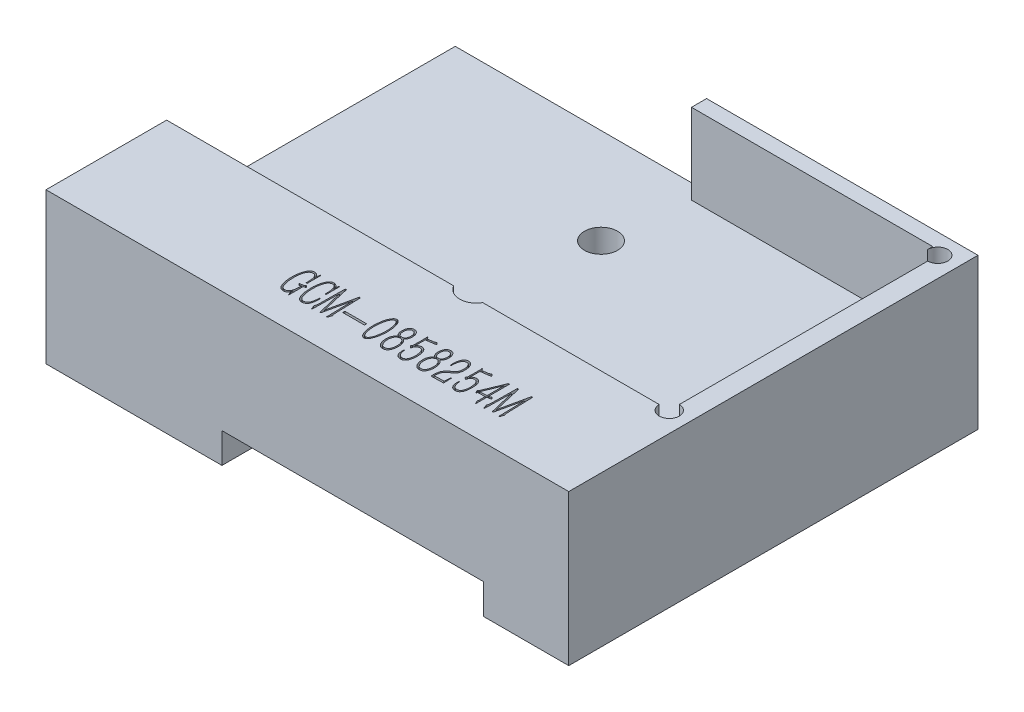
from build123d import *

# Parameters (mm, degrees)
SKETCH_1_W           = 50
SKETCH_1_H           = 26.71
EXTRUDE_1_DEPTH      = 6
EXTRUDE_2_DEPTH      = 8
EXTRUDE_2_DEPTH_BACK = 6
SKETCH_12_W          = 2
SKETCH_12_H          = 8
CUT_EXTRUDE_5_DEPTH  = 25
SKETCH_13_R          = 1
CUT_EXTRUDE_6_DEPTH  = 8
SKETCH_15_W          = 52
SKETCH_15_H          = 14
EXTRUDE_3_DEPTH      = 10
SKETCH_5_W           = 25
SKETCH_5_H           = 25
SKETCH_5_R           = 1.193891983
CUT_EXTRUDE_1_DEPTH  = 2
HOLE_WIZARD_M4_2_D   = 3.3
SKETCH_16_W          = 25
SKETCH_16_H          = 2
CUT_EXTRUDE_7_DEPTH  = 51.576765388
SKETCH_17_W          = 25.299491501
SKETCH_17_H          = 2
CUT_EXTRUDE_8_DEPTH  = 1
SKETCH_18_R          = 1
CUT_EXTRUDE_9_DEPTH  = 2
FILLET_1_R           = 1
SKETCH_19_W          = 24
SKETCH_19_H          = 8
CUT_EXTRUDE_10_DEPTH = 0.5
SKETCH_20_W          = 2.164287237
SKETCH_20_H          = 0.217025357
CUT_EXTRUDE_11_DEPTH = 0.5
EXTRUDE_START        = 1
EXTRUDE_4_DEPTH      = 1
HOLE_WIZARD_M4_3_D   = 3.3


with BuildPart() as part:
    # 草图1 → 凸台-拉伸1 (new body)
    with BuildSketch(Plane(origin=(0, 0, 0), x_dir=(1, 0, 0), z_dir=(0, 1, 0))):
        Rectangle(SKETCH_1_W, SKETCH_1_H)
    extrude(amount=EXTRUDE_1_DEPTH)

    # 草图2 → 凸台-拉伸2 (add, two sides: drawn at the far end of the back side and taken through both)
    with BuildSketch(Plane(origin=(0, 6, 0), x_dir=(1, 0, 0), z_dir=(0, 1, 0)).offset(-EXTRUDE_2_DEPTH_BACK)):
        Polygon((25, 13.355), (-25, 13.355), (-25, 15.355), (27, 15.355), (27, -15.355), (-25, -15.355), (-25, -13.355), (25, -13.355), align=None)
    extrude(amount=EXTRUDE_2_DEPTH + EXTRUDE_2_DEPTH_BACK)

    # 草图12 → 切除-拉伸5 (cut)
    with BuildSketch(Plane.ZY.offset(25)):
        with Locations((-14.355, 10)):
            Rectangle(SKETCH_12_W, SKETCH_12_H)
    extrude(amount=-CUT_EXTRUDE_5_DEPTH, mode=Mode.SUBTRACT)

    # 草图13 → 切除-拉伸6 (cut)
    with BuildSketch(Plane(origin=(0, 14, 0), x_dir=(1, 0, 0), z_dir=(0, 1, 0))):
        with Locations((25, -13.355)):
            Circle(SKETCH_13_R)
        with Locations((25, 13.355)):
            Circle(SKETCH_13_R)
    extrude(amount=-CUT_EXTRUDE_6_DEPTH, mode=Mode.SUBTRACT)

    # 草图15 → 凸台-拉伸3 (add)
    with BuildSketch(Plane.XY.offset(15.355)):
        with Locations((1, 7)):
            Rectangle(SKETCH_15_W, SKETCH_15_H)
    extrude(amount=EXTRUDE_3_DEPTH)

    # 草图5 → 切除-拉伸1 (cut)
    with BuildSketch(Plane.XZ):
        with Locations((5.003200973, 12.555508499)):
            Rectangle(SKETCH_5_W, SKETCH_5_H)
        with Locations(Location((5.003200973, 12.555508499, 0), (0, 0, 270))):
            Circle(SKETCH_5_R, mode=Mode.SUBTRACT)
    extrude(amount=-CUT_EXTRUDE_1_DEPTH, mode=Mode.SUBTRACT)

    # M4 螺纹孔2 (through all)
    with Locations(Plane(origin=(5.003200973, 2, 12.555508499), x_dir=(0, 0, -1), z_dir=(0, -1, 0))):
        with Locations((0, 0)):
            Hole(HOLE_WIZARD_M4_2_D / 2)

    # 草图16 → 切除-拉伸7 (cut, through all)
    with BuildSketch(Plane(origin=(0, 0, 25.055508499), x_dir=(-1, 0, 0), z_dir=(0, 0, -1))):
        with Locations((-5.003200973, 1)):
            Rectangle(SKETCH_16_W, SKETCH_16_H)
    extrude(amount=-CUT_EXTRUDE_7_DEPTH, mode=Mode.SUBTRACT)

    # 草图17 → 切除-拉伸8 (cut)
    with BuildSketch(Plane.ZY.offset(-17.503200973)):
        with Locations((12.705254249, 1)):
            Rectangle(SKETCH_17_W, SKETCH_17_H)
    extrude(amount=-CUT_EXTRUDE_8_DEPTH, mode=Mode.SUBTRACT)

    # 草图18 → 切除-拉伸9 (cut)
    with BuildSketch(Plane(origin=(0, 0, 0), x_dir=(-1, 0, 0), z_dir=(0, -1, 0))):
        with Locations((7.496799027, -0.055508499)):
            Circle(SKETCH_18_R)
    extrude(amount=-CUT_EXTRUDE_9_DEPTH, mode=Mode.SUBTRACT)

    # 圆角1
    fillet_1_edges = [part.edges().sort_by_distance(p)[0] for p in [
        (18.503200973, 1, 0.055508499),
    ]]
    fillet(fillet_1_edges, radius=FILLET_1_R)

    # 草图19 → 切除-拉伸10 (cut)
    with BuildSketch(Plane.XY.offset(-13.355)):
        with Locations((12, 10)):
            Rectangle(SKETCH_19_W, SKETCH_19_H)
    extrude(amount=-CUT_EXTRUDE_10_DEPTH, mode=Mode.SUBTRACT)

    # 草图20 → 切除-拉伸11 (cut)
    # profile 1 of 12: a face of its own
    with BuildSketch(Plane(origin=(0, 14, 0), x_dir=(1, 0, 0), z_dir=(0, 1, 0))):
        with BuildLine():
            add(Edge.make_bspline(
                [(-4.00322499, -20.941046489), (-4.016208165, -20.946134933), (-4.039557737, -20.955286238), (-4.069755584, -20.969101462), (-4.09239299, -20.97845731), (-4.104420334, -20.984266336), (-4.109127398, -20.986539777)],
                knots=[0, 0, 0, 0, 1.451194949, 2.609899258, 3.455965341, 4, 4, 4, 4], degree=3))
            Line((-4.109127398, -20.986539777), (-4.169536517, -21.016371441))
            Line((-4.169536517, -21.016371441), (-4.310491131, -20.88585791))
            add(Edge.make_bspline(
                [(-4.310491131, -20.88585791), (-4.319265376, -20.879305726), (-4.332540496, -20.869392505), (-4.346154868, -20.849541147), (-4.339322258, -20.837419614), (-4.336768999, -20.826762022), (-4.326684369, -20.819987224), (-4.319217156, -20.816814195), (-4.31496588, -20.815007708)],
                knots=[0, 0, 0, 0, 2.086102323, 3.156198184, 3.883632954, 4.481724143, 5.135606675, 6, 6, 6, 6], degree=3))
            Line((-4.31496588, -20.815007708), (-4.19414764, -20.815007708))
            Line((-4.19414764, -20.815007708), (-4.088991024, -20.790396585))
            Line((-4.088991024, -20.790396585), (-3.957731702, -20.76503967))
            add(Edge.make_bspline(
                [(-3.957731702, -20.76503967), (-3.948452833, -20.763564812), (-3.924289136, -20.75972404), (-3.887903807, -20.744797324), (-3.849982434, -20.73039493), (-3.833574882, -20.711825016), (-3.827218171, -20.70463055)],
                knots=[0, 0, 0, 0, 0.766069967, 1.994971973, 3.223200239, 4, 4, 4, 4], degree=3))
            Line((-3.827218171, -20.70463055), (-3.796640715, -20.653916721))
            Line((-3.796640715, -20.653916721), (-3.645990811, -20.790396585))
            add(Edge.make_bspline(
                [(-3.645990811, -20.790396585), (-3.640290031, -20.797281724), (-3.629288369, -20.810569024), (-3.625329563, -20.83398811), (-3.625480682, -20.85402877), (-3.632690216, -20.862400903), (-3.635549729, -20.865721537)],
                knots=[0, 0, 0, 0, 1.265348548, 2.441935808, 3.382026096, 4, 4, 4, 4], degree=3))
            Line((-3.635549729, -20.865721537), (-3.670601934, -20.870942078))
            Line((-3.670601934, -20.870942078), (-3.862270376, -20.900773742))
            Line((-3.862270376, -20.900773742), (-3.862270376, -22.15444943))
            add(Edge.make_bspline(
                [(-3.862270376, -22.15444943), (-3.862194326, -22.168869808), (-3.862051392, -22.195972612), (-3.862969898, -22.23349516), (-3.863704128, -22.265103577), (-3.864345315, -22.290378887), (-3.865295365, -22.310084876), (-3.86808424, -22.322769885), (-3.868921226, -22.331203202), (-3.878136834, -22.337107117), (-3.887680666, -22.307547547), (-3.90633052, -22.290043541), (-3.921977716, -22.260077255), (-3.929499907, -22.241930406), (-3.932374787, -22.234994923)],
                knots=[0, 0, 0, 0, 1.751209942, 3.291362944, 4.559839881, 5.586855149, 6.374199429, 6.925174992, 7.211613548, 7.320476949, 8.136254313, 9.593373124, 11.080219477, 12, 12, 12, 12], degree=3))
            Line((-3.932374787, -22.234994923), (-3.957731702, -22.169365262))
            Line((-3.957731702, -22.169365262), (-4.00322499, -22.083599227))
            add(Edge.make_bspline(
                [(-4.00322499, -22.083599227), (-4.010377816, -22.070226732), (-4.023080046, -22.046479405), (-4.026909066, -22.019890533), (-4.028581904, -22.008274275)],
                knots=[0, 0, 0, 0, 1.126231633, 2, 2, 2, 2], degree=3))
            Line((-4.028581904, -22.008274275), (-4.012920281, -21.958306238))
            Line((-4.012920281, -21.958306238), (-3.983088616, -21.777078878))
            add(Edge.make_bspline(
                [(-3.983088616, -21.777078878), (-3.988908413, -21.791957758), (-4.003178463, -21.828440539), (-4.024573372, -21.892387112), (-4.054319806, -21.970808337), (-4.088185156, -22.040686884), (-4.12202528, -22.098085326), (-4.156519618, -22.136913001), (-4.19643111, -22.172407898), (-4.242063342, -22.203305292), (-4.291747426, -22.227976039), (-4.343065878, -22.248470881), (-4.396797414, -22.259957738), (-4.433255997, -22.263205986), (-4.451445744, -22.264826587)],
                knots=[0, 0, 0, 0, 0.787433887, 1.930775596, 3.32352342, 4.918383998, 5.754919964, 6.59762641, 7.465700887, 8.383390173, 9.30410181, 10.196234789, 11.100073855, 12, 12, 12, 12], degree=3))
            add(Edge.make_bspline(
                [(-4.451445744, -22.264826587), (-4.484566546, -22.266404482), (-4.550607206, -22.2695507), (-4.647865062, -22.250638629), (-4.73772451, -22.215671253), (-4.80770888, -22.177461476), (-4.857807267, -22.137391341), (-4.893570186, -22.100765561), (-4.92973188, -22.059230368), (-4.963775125, -22.010125912), (-4.997574491, -21.954683228), (-5.030107316, -21.891629242), (-5.062774543, -21.821757915), (-5.094990891, -21.74510214), (-5.12441859, -21.662139493), (-5.151277018, -21.573482965), (-5.17594281, -21.479753702), (-5.203816549, -21.349887773), (-5.231191149, -21.19121642), (-5.251420311, -21.004600314), (-5.259325014, -20.818317979), (-5.262741887, -20.622844621), (-5.257897538, -20.415099221), (-5.24390618, -20.273500272), (-5.236764304, -20.201221217)],
                knots=[0, 0, 0, 0, 0.886537814, 1.767696987, 2.630539397, 3.466390029, 3.89319088, 4.345660666, 4.837284351, 5.368061509, 5.945350042, 6.577414686, 7.26921622, 8.013189797, 8.805909171, 9.628228833, 10.496409839, 11.40375193, 13.18882713, 14.811163384, 16.432855943, 18.186087669, 20.053191931, 22, 22, 22, 22], degree=3))
            add(Edge.make_bspline(
                [(-5.236764304, -20.201221217), (-5.2284205, -20.140966512), (-5.21123481, -20.016860195), (-5.179797886, -19.861651059), (-5.146656903, -19.735905389), (-5.116897003, -19.642423342), (-5.081898985, -19.551477016), (-5.042172172, -19.464482379), (-4.999244185, -19.384484093), (-4.954012971, -19.314305051), (-4.906116238, -19.256276801), (-4.856728494, -19.209778031), (-4.80796183, -19.173802126), (-4.763693799, -19.144320556), (-4.722696906, -19.122764519), (-4.672665798, -19.103785839), (-4.609155186, -19.090640936), (-4.558145176, -19.085774652), (-4.531991237, -19.083279602)],
                knots=[0, 0, 0, 0, 2.031066659, 4.183377905, 5.28281558, 6.372336155, 7.457674051, 8.534949753, 9.563865233, 10.48716063, 11.318346232, 12.070077728, 12.745820699, 13.339884663, 13.84484432, 14.288876811, 15.122670028, 16, 16, 16, 16], degree=3))
            add(Edge.make_bspline(
                [(-4.531991237, -19.083279602), (-4.5155496, -19.083610515), (-4.483479316, -19.084255979), (-4.436771941, -19.092189344), (-4.392490529, -19.104017187), (-4.335995444, -19.126231338), (-4.268428875, -19.166918744), (-4.210889055, -19.22215658), (-4.169059556, -19.268517952), (-4.14153157, -19.299047973), (-4.1206389, -19.325919444), (-4.109062436, -19.342769031), (-4.103906856, -19.350272997)],
                knots=[0, 0, 0, 0, 0.935591886, 1.824921544, 2.69059853, 3.542616212, 5.276632114, 7.140836838, 8.062935201, 8.835586858, 9.48142842, 10, 10, 10, 10], degree=3))
            Line((-4.103906856, -19.350272997), (-4.06363411, -19.43081849))
            Line((-4.06363411, -19.43081849), (-4.00322499, -19.073584311))
            Line((-4.00322499, -19.073584311), (-3.94281587, -19.073584311))
            Line((-3.94281587, -19.073584311), (-3.94281587, -20.437637156))
            Line((-3.94281587, -20.437637156), (-4.048718278, -20.442857697))
            add(Edge.make_bspline(
                [(-4.048718278, -20.442857697), (-4.048736175, -20.41899237), (-4.04877458, -20.367781356), (-4.048447128, -20.287480131), (-4.049799057, -20.202180595), (-4.053009359, -20.128844386), (-4.056851987, -20.066935426), (-4.061675138, -20.014279537), (-4.066419078, -19.955013531), (-4.076701106, -19.870515107), (-4.088521091, -19.76813413), (-4.111969424, -19.654701035), (-4.143957882, -19.550618839), (-4.184968852, -19.471807126), (-4.22144348, -19.411665644), (-4.253302773, -19.373783157), (-4.286167302, -19.340720348), (-4.334080883, -19.30624687), (-4.402172615, -19.2739279), (-4.461237912, -19.264762175), (-4.491718491, -19.260032212)],
                knots=[0, 0, 0, 0, 0.934719612, 2.005752502, 3.145108456, 4.275610044, 4.880538166, 5.574305271, 6.346515312, 7.208856073, 8.908119904, 10.380417914, 11.741392999, 13.156562568, 13.848071288, 14.491354542, 15.090376944, 15.668787155, 16.796980267, 18, 18, 18, 18], degree=3))
            add(Edge.make_bspline(
                [(-4.491718491, -19.260032212), (-4.515384843, -19.260041086), (-4.56132202, -19.26005831), (-4.628636712, -19.27244011), (-4.691179221, -19.294904093), (-4.75019857, -19.326810828), (-4.804884912, -19.370266399), (-4.854639819, -19.426667372), (-4.902015792, -19.494288334), (-4.943651886, -19.573320858), (-4.981822683, -19.65835602), (-5.014625735, -19.746896912), (-5.042600559, -19.837157574), (-5.070085388, -19.958283009), (-5.095141775, -20.106440807), (-5.112202177, -20.279699479), (-5.119086433, -20.447765735), (-5.119976822, -20.558450984), (-5.120420813, -20.613643975)],
                knots=[0, 0, 0, 0, 0.687070091, 1.333625864, 1.978401157, 2.612429783, 3.276252408, 3.997857604, 4.791996822, 5.671793893, 6.590722303, 7.501081097, 8.415734735, 9.336282353, 11.110559688, 12.781456087, 14.395079127, 16, 16, 16, 16], degree=3))
            add(Edge.make_bspline(
                [(-5.120420813, -20.613643975), (-5.119210869, -20.686763116), (-5.116705061, -20.838193628), (-5.100925273, -21.028429507), (-5.082500687, -21.182183521), (-5.065838588, -21.292531707), (-5.044582806, -21.395367672), (-5.021915374, -21.490774213), (-4.996469314, -21.577378349), (-4.971065577, -21.654873965), (-4.946838257, -21.723388987), (-4.921290168, -21.782865926), (-4.894831568, -21.83514063), (-4.867575288, -21.881539496), (-4.83800336, -21.922172233), (-4.798814896, -21.968760668), (-4.74582481, -22.014428126), (-4.680148364, -22.058140913), (-4.60828018, -22.085557321), (-4.557822959, -22.091167938), (-4.531991237, -22.09404031)],
                knots=[0, 0, 0, 0, 2.298361562, 4.759931027, 5.995784954, 7.166237941, 8.266635837, 9.295830317, 10.247969411, 11.103023622, 11.859473385, 12.531579901, 13.136194532, 13.700421914, 14.220962996, 14.714278152, 15.611161906, 16.408908565, 17.185436095, 18, 18, 18, 18], degree=3))
            add(Edge.make_bspline(
                [(-4.531991237, -22.09404031), (-4.508321089, -22.094356381), (-4.460809698, -22.094990808), (-4.389578027, -22.0810146), (-4.320597103, -22.053757857), (-4.256335163, -22.009646004), (-4.198676175, -21.949622734), (-4.148541831, -21.874397959), (-4.106259994, -21.787466498), (-4.077058449, -21.690663642), (-4.054815601, -21.590335104), (-4.040864638, -21.488403284), (-4.030145719, -21.389586999), (-4.020792144, -21.292886091), (-4.01285169, -21.194712396), (-4.009956295, -21.127508145), (-4.008445531, -21.092442185)],
                knots=[0, 0, 0, 0, 0.783104963, 1.571870426, 2.389098297, 3.225710409, 4.134881124, 5.131509479, 6.211508184, 7.327051887, 8.474825503, 9.6158629, 10.735296491, 11.77020564, 12.836533725, 14, 14, 14, 14], degree=3))
            Line((-4.008445531, -21.092442185), (-4.00322499, -20.941046489))
        make_face()
    # profile 2 of 12: a face of its own
    with BuildSketch(Plane(origin=(0, 14, 0), x_dir=(1, 0, 0), z_dir=(0, 1, 0))):
        with BuildLine():
            Line((-2.154407602, -19.410682117), (-2.118609605, -19.113857058))
            Line((-2.118609605, -19.113857058), (-2.043284653, -19.113857058))
            Line((-2.043284653, -19.113857058), (-2.043284653, -20.457773529))
            Line((-2.043284653, -20.457773529), (-2.138745978, -20.457773529))
            add(Edge.make_bspline(
                [(-2.138745978, -20.457773529), (-2.138876588, -20.433408673), (-2.139149851, -20.382432302), (-2.142066206, -20.300917024), (-2.143927799, -20.207924384), (-2.147096132, -20.103021069), (-2.150073383, -19.990700858), (-2.161063433, -19.875689739), (-2.177864543, -19.759453191), (-2.203504204, -19.642860389), (-2.237220963, -19.530426936), (-2.277058616, -19.444850599), (-2.314255361, -19.384763308), (-2.344725383, -19.345702118), (-2.378688875, -19.312420207), (-2.42729155, -19.276208885), (-2.493672037, -19.239726735), (-2.552414297, -19.229393787), (-2.581746191, -19.224234215)],
                knots=[0, 0, 0, 0, 0.822473136, 1.720785642, 2.753326599, 3.962261781, 5.264018637, 6.545024146, 7.860049611, 9.226346671, 10.572050264, 11.814683136, 12.399128484, 12.954850798, 13.483022901, 13.998303406, 15.000488703, 16, 16, 16, 16], degree=3))
            add(Edge.make_bspline(
                [(-2.581746191, -19.224234215), (-2.604171752, -19.223635971), (-2.648928554, -19.222441999), (-2.715470417, -19.235897957), (-2.77957144, -19.261012011), (-2.841070697, -19.297402539), (-2.899655766, -19.344168636), (-2.951615038, -19.403995633), (-3.001022312, -19.472677428), (-3.041999269, -19.553100707), (-3.078310945, -19.639533859), (-3.112088517, -19.729461749), (-3.138286303, -19.823187899), (-3.166624137, -19.950531395), (-3.191820627, -20.108507594), (-3.209923519, -20.292400874), (-3.219385786, -20.464123388), (-3.222715836, -20.624333274), (-3.219426666, -20.778301748), (-3.213961579, -20.879904272), (-3.211194306, -20.931351198)],
                knots=[0, 0, 0, 0, 0.603095173, 1.203653813, 1.814626149, 2.451293107, 3.123130818, 3.825388984, 4.580186105, 5.398460658, 6.251023789, 7.107448911, 7.985514538, 8.871470416, 10.622993602, 12.29317529, 13.850163291, 15.257553743, 16.61134915, 18, 18, 18, 18], degree=3))
            add(Edge.make_bspline(
                [(-3.211194306, -20.931351198), (-3.207170606, -20.977359554), (-3.198937242, -21.07150264), (-3.185234012, -21.190929473), (-3.169389786, -21.292024575), (-3.153679955, -21.375332208), (-3.134097607, -21.465554026), (-3.112126059, -21.559223367), (-3.087397102, -21.648837634), (-3.064178004, -21.728305174), (-3.04077334, -21.793204716), (-3.009977525, -21.860195325), (-2.966405781, -21.930500735), (-2.909802753, -22.006276702), (-2.846330468, -22.068971379), (-2.778281637, -22.116694245), (-2.702359092, -22.144433145), (-2.649341941, -22.147597897), (-2.622018938, -22.149228888)],
                knots=[0, 0, 0, 0, 1.515526627, 3.101096572, 3.943353373, 4.87293365, 5.882541642, 6.972773351, 8.029529644, 8.932786276, 9.68898916, 10.291221641, 11.348890653, 12.39638072, 13.388602443, 14.264213047, 15.105442077, 16, 16, 16, 16], degree=3))
            add(Edge.make_bspline(
                [(-2.622018938, -22.149228888), (-2.596556149, -22.149572381), (-2.544703564, -22.150271873), (-2.467472713, -22.130630566), (-2.392502429, -22.099255012), (-2.322475062, -22.052927648), (-2.260688938, -21.991423792), (-2.208141547, -21.914894349), (-2.166471294, -21.823747635), (-2.13767717, -21.71962388), (-2.114446496, -21.607286339), (-2.09934554, -21.511422195), (-2.088659764, -21.438967677), (-2.081745669, -21.395528829), (-2.077409922, -21.363154942), (-2.074865731, -21.345512812), (-2.073862109, -21.338553414)],
                knots=[0, 0, 0, 0, 0.974493461, 1.984464659, 3.032762083, 4.086915356, 5.187622472, 6.361151533, 7.634420725, 9.018373663, 10.501751059, 12.040324543, 12.745324753, 13.31527632, 13.729892907, 14, 14, 14, 14], degree=3))
            Line((-2.073862109, -21.338553414), (-2.048505194, -21.072305811))
            Line((-2.048505194, -21.072305811), (-1.967959701, -21.076780561))
            add(Edge.make_bspline(
                [(-1.967959701, -21.076780561), (-1.967859306, -21.101641251), (-1.96767658, -21.146889221), (-1.96878714, -21.208534003), (-1.969004704, -21.257530603), (-1.971002495, -21.297532411), (-1.97229919, -21.335108312), (-1.975564267, -21.377116503), (-1.979988065, -21.427092446), (-1.987955934, -21.500851826), (-1.995977646, -21.589254162), (-2.00720319, -21.688217402), (-2.023915107, -21.784912689), (-2.055274007, -21.885840383), (-2.09844439, -21.991791883), (-2.14720582, -22.076332527), (-2.193687058, -22.138880924), (-2.234366873, -22.180553254), (-2.279506765, -22.218572139), (-2.329815936, -22.250699886), (-2.382905973, -22.277712306), (-2.438219132, -22.296876512), (-2.494299648, -22.311271324), (-2.532685995, -22.314115639), (-2.551914527, -22.315540416)],
                knots=[0, 0, 0, 0, 1.082557886, 1.97032136, 2.684891572, 3.215786613, 3.714233695, 4.322010655, 5.050226996, 5.899051791, 7.552532718, 8.915438272, 10.236158893, 11.818471953, 13.507262255, 15.209909354, 16.052150521, 16.894322113, 17.739826851, 18.616631911, 19.488074199, 20.326969254, 21.161943562, 22, 22, 22, 22], degree=3))
            add(Edge.make_bspline(
                [(-2.551914527, -22.315540416), (-2.584079368, -22.316949374), (-2.649594289, -22.31981921), (-2.746239019, -22.297782878), (-2.836637038, -22.262867674), (-2.905469024, -22.222712097), (-2.954569428, -22.182880112), (-2.989580417, -22.146238332), (-3.024963202, -22.104498645), (-3.058841911, -22.055763531), (-3.092725204, -22.001268409), (-3.124291133, -21.940185562), (-3.154870662, -21.873380859), (-3.195808312, -21.774771187), (-3.239946492, -21.63822839), (-3.275155409, -21.492510942), (-3.298835076, -21.36649484), (-3.313088077, -21.263602705), (-3.326812519, -21.154760322), (-3.341340744, -21.003174168), (-3.353313344, -20.81470435), (-3.359433769, -20.592028989), (-3.35298418, -20.371391636), (-3.335624504, -20.224993754), (-3.326792004, -20.150507388)],
                knots=[0, 0, 0, 0, 0.828879423, 1.68830212, 2.536676829, 3.328986324, 3.73541648, 4.167069034, 4.63682846, 5.148487351, 5.699502401, 6.294435402, 6.924061178, 7.598240742, 9.053084533, 10.627089957, 11.470192478, 12.366164513, 13.311378798, 14.305576584, 16.301598498, 18.191207909, 20.062109376, 22, 22, 22, 22], degree=3))
            add(Edge.make_bspline(
                [(-3.326792004, -20.150507388), (-3.316713692, -20.075937115), (-3.296656394, -19.927531496), (-3.251900965, -19.747489323), (-3.209299455, -19.612005744), (-3.176197556, -19.521661845), (-3.141048216, -19.443059741), (-3.105013079, -19.37453762), (-3.066323308, -19.314858686), (-3.025645632, -19.261256706), (-2.980223185, -19.215207489), (-2.933997005, -19.174345469), (-2.88757831, -19.141001001), (-2.844915715, -19.113335692), (-2.807340436, -19.09098579), (-2.760685213, -19.071480017), (-2.699251301, -19.056461985), (-2.64871531, -19.057905776), (-2.622018938, -19.058668479)],
                knots=[0, 0, 0, 0, 2.546659555, 5.068220541, 6.268960188, 7.35572531, 8.324149365, 9.182807276, 9.974388089, 10.730435642, 11.456747585, 12.160764052, 12.817438768, 13.389505863, 13.883390408, 14.294592413, 15.099093679, 16, 16, 16, 16], degree=3))
            add(Edge.make_bspline(
                [(-2.622018938, -19.058668479), (-2.594720109, -19.063343102), (-2.538769509, -19.072924025), (-2.456950595, -19.102940267), (-2.376148115, -19.144383606), (-2.306208003, -19.202891246), (-2.244345497, -19.263340134), (-2.213455857, -19.308998494), (-2.199155098, -19.330136623)],
                knots=[0, 0, 0, 0, 0.959137923, 1.965811105, 3.01152559, 4.09188384, 5.116612916, 6, 6, 6, 6], degree=3))
            Line((-2.199155098, -19.330136623), (-2.154407602, -19.410682117))
        make_face()
    # profile 3 of 12: a face of its own
    with BuildSketch(Plane(origin=(0, 14, 0), x_dir=(1, 0, 0), z_dir=(0, 1, 0))):
        with BuildLine():
            Line((-0.16388981, -19.033311565), (-0.048292111, -19.033311565))
            Line((-0.048292111, -19.033311565), (0.0218123, -21.394487785))
            Line((0.0218123, -21.394487785), (0.027032841, -21.615987891))
            add(Edge.make_bspline(
                [(0.027032841, -21.615987891), (0.02728775, -21.640600762), (0.027720752, -21.682409529), (0.031119135, -21.738541655), (0.038839539, -21.785297785), (0.048676617, -21.82975127), (0.061704269, -21.871976917), (0.075187188, -21.908250183), (0.088937098, -21.934791273), (0.096218672, -21.955829882), (0.092772439, -21.975958119), (0.086891098, -22.001514028), (0.073113482, -22.038334211), (0.063236362, -22.067172672), (0.057610297, -22.083599227)],
                knots=[0, 0, 0, 0, 1.833532234, 3.114538037, 4.183068399, 5.360011406, 6.502211209, 7.47535404, 8.229329157, 8.745810393, 9.081162989, 9.727925243, 10.705812996, 12, 12, 12, 12], degree=3))
            Line((0.057610297, -22.083599227), (0.001675927, -22.255131296))
            add(Edge.make_bspline(
                [(0.001675927, -22.255131296), (-0.004471413, -22.270819002), (-0.015334983, -22.298542295), (-0.030223982, -22.334128973), (-0.040683875, -22.358494542), (-0.050532526, -22.374113089), (-0.061062382, -22.382349737), (-0.073729065, -22.385202422), (-0.083436383, -22.376888784), (-0.086693779, -22.369660466), (-0.088564858, -22.365508454)],
                knots=[0, 0, 0, 0, 2.257142557, 3.988819353, 5.165733309, 5.812331029, 6.431774305, 6.935717094, 7.388666149, 8, 8, 8, 8], degree=3))
            add(Edge.make_bspline(
                [(-0.088564858, -22.365508454), (-0.091709613, -22.359406575), (-0.099712031, -22.343879201), (-0.099774946, -22.311108277), (-0.099710665, -22.267286988), (-0.095922051, -22.233764252), (-0.093785399, -22.21485855)],
                knots=[0, 0, 0, 0, 0.533370556, 1.357261302, 2.50958371, 4, 4, 4, 4], degree=3))
            Line((-0.093785399, -22.21485855), (-0.10348069, -21.897897118))
            Line((-0.10348069, -21.897897118), (-0.16388981, -19.717948258))
            Line((-0.16388981, -19.717948258), (-0.727708263, -22.275267669))
            Line((-0.727708263, -22.275267669), (-0.82391538, -22.270047128))
            Line((-0.82391538, -22.270047128), (-1.432481329, -19.747779922))
            Line((-1.432481329, -19.747779922), (-1.472754076, -21.922508241))
            Line((-1.472754076, -21.922508241), (-1.483195158, -22.234994923))
            add(Edge.make_bspline(
                [(-1.483195158, -22.234994923), (-1.483317476, -22.257680517), (-1.483536314, -22.2982673), (-1.490767929, -22.344855094), (-1.49790397, -22.373779538), (-1.503389727, -22.386817863), (-1.509750044, -22.396476607), (-1.515590443, -22.396208072), (-1.518247363, -22.396085909)],
                knots=[0, 0, 0, 0, 2.35867652, 4.21990684, 4.917432392, 5.427710553, 5.739653463, 6, 6, 6, 6], degree=3))
            add(Edge.make_bspline(
                [(-1.518247363, -22.396085909), (-1.52174637, -22.395487586), (-1.529070546, -22.394235166), (-1.542834656, -22.388031109), (-1.553274356, -22.364631364), (-1.562030551, -22.338952792), (-1.570051235, -22.313878924), (-1.574199026, -22.297841971), (-1.57781604, -22.287587672), (-1.578449433, -22.282237223), (-1.578656483, -22.280488211)],
                knots=[0, 0, 0, 0, 0.61831469, 1.294266409, 2.516485019, 4.811391437, 6.122679461, 7.065853468, 7.69463614, 8, 8, 8, 8], degree=3))
            Line((-1.578656483, -22.280488211), (-1.669643059, -22.053767563))
            add(Edge.make_bspline(
                [(-1.669643059, -22.053767563), (-1.672099293, -22.042392722), (-1.676923416, -22.020052171), (-1.67602364, -21.984636196), (-1.666494971, -21.947217338), (-1.652287349, -21.908286204), (-1.63783208, -21.872634714), (-1.627562909, -21.846473939), (-1.621731478, -21.826543136), (-1.619511893, -21.806419742), (-1.616116854, -21.780143999), (-1.61448092, -21.749229939), (-1.612620734, -21.71837918), (-1.609938439, -21.691834472), (-1.608913061, -21.671882597), (-1.60711897, -21.65801403), (-1.606022903, -21.646084156), (-1.605375984, -21.631902451), (-1.604847014, -21.611498623), (-1.602805746, -21.584940848), (-1.602811489, -21.552080964), (-1.600579349, -21.513337081), (-1.600513412, -21.468309464), (-1.599392495, -21.436249501), (-1.598792857, -21.419098907)],
                knots=[0, 0, 0, 0, 1.187984124, 2.333238898, 3.586201942, 5.123185855, 6.573707022, 7.523685523, 7.99901539, 8.693496643, 9.589827362, 10.711954829, 11.85946849, 12.753267707, 13.442133117, 13.902940376, 14.183976602, 14.668078378, 15.355532658, 16.272922794, 17.392740166, 18.716797284, 20.243638767, 22, 22, 22, 22], degree=3))
            Line((-1.598792857, -21.419098907), (-1.563740651, -19.033311565))
            Line((-1.563740651, -19.033311565), (-1.442922411, -19.033311565))
            Line((-1.442922411, -19.033311565), (-0.783642633, -21.882235494))
            Line((-0.783642633, -21.882235494), (-0.16388981, -19.033311565))
        make_face()
    # profile 4 of 12: a face of its own
    with BuildSketch(Plane(origin=(0, 14, 0), x_dir=(1, 0, 0), z_dir=(0, 1, 0))):
        with Locations((1.417934184, -21.064474999)):
            Rectangle(SKETCH_20_W, SKETCH_20_H)
    # profile 5 of 12: a face of its own
    with BuildSketch(Plane(origin=(0, 14, 0), x_dir=(1, 0, 0), z_dir=(0, 1, 0))):
        with BuildLine():
            add(Edge.make_bspline(
                [(2.970672304, -20.633780348), (2.973102695, -20.58553336), (2.978082112, -20.486684321), (2.991618596, -20.335172096), (3.011585352, -20.177109703), (3.034739176, -20.014782727), (3.066777831, -19.854426378), (3.10778131, -19.701928821), (3.160125526, -19.560931655), (3.212356864, -19.45266389), (3.256510864, -19.373283307), (3.288637115, -19.320477433), (3.319200768, -19.272855531), (3.349312981, -19.23148091), (3.378868215, -19.196249457), (3.406125641, -19.1657008), (3.433634433, -19.141917202), (3.468134441, -19.118333584), (3.510128386, -19.097299497), (3.558791512, -19.0788985), (3.60561608, -19.068254108), (3.636119978, -19.068328085), (3.650834247, -19.06836377)],
                knots=[0, 0, 0, 0, 1.583211401, 3.243703523, 4.983978234, 6.804605119, 8.6166428, 10.340282122, 11.974804003, 13.53820457, 14.274983449, 14.951299633, 15.563740824, 16.129235462, 16.626851747, 17.070813204, 17.469389546, 17.815167281, 18.438300608, 19.002855301, 19.519003895, 20, 20, 20, 20], degree=3))
            add(Edge.make_bspline(
                [(3.650834247, -19.06836377), (3.664904434, -19.070824104), (3.694622857, -19.076020712), (3.738558814, -19.095342711), (3.785190504, -19.121038803), (3.834804181, -19.154343218), (3.884338717, -19.199122808), (3.93024541, -19.258432081), (3.97286405, -19.330865427), (4.025826653, -19.445502368), (4.084189648, -19.600884942), (4.130015982, -19.764034411), (4.159783341, -19.900256627), (4.179196421, -20.008939943), (4.194632928, -20.124187624), (4.211209287, -20.286203452), (4.225992353, -20.493811026), (4.228374931, -20.661097618), (4.229568533, -20.744903297)],
                knots=[0, 0, 0, 0, 0.36369769, 0.768186139, 1.217229854, 1.724510149, 2.290946358, 2.914777825, 3.632489608, 4.433551378, 6.137860108, 7.866765886, 8.757390638, 9.699141408, 10.686159515, 11.726895222, 13.859299765, 16, 16, 16, 16], degree=3))
            add(Edge.make_bspline(
                [(4.229568533, -20.744903297), (4.22500299, -20.812055869), (4.215619848, -20.950068413), (4.193297892, -21.161440176), (4.156482871, -21.381332183), (4.110155834, -21.566559484), (4.065346063, -21.714040043), (4.027345826, -21.820460633), (3.984827757, -21.920959646), (3.93944776, -22.014563128), (3.892238405, -22.097887351), (3.843369593, -22.167903829), (3.791730063, -22.221830602), (3.738677221, -22.260566236), (3.686877933, -22.286816808), (3.637383966, -22.303601058), (3.590250684, -22.312917562), (3.559627641, -22.311162242), (3.54493184, -22.310319875)],
                knots=[0, 0, 0, 0, 1.760488992, 3.618172134, 5.557361062, 7.587083219, 8.607294374, 9.588398617, 10.541277716, 11.460251193, 12.307925722, 13.044175775, 13.687957546, 14.251129358, 14.754223989, 15.200440537, 15.616296545, 16, 16, 16, 16], degree=3))
            add(Edge.make_bspline(
                [(3.54493184, -22.310319875), (3.530889592, -22.30834602), (3.501303659, -22.304187259), (3.456707277, -22.286686706), (3.41026605, -22.259723066), (3.360686845, -22.224179449), (3.310763325, -22.175347844), (3.262689918, -22.11218753), (3.216588164, -22.034355311), (3.172776229, -21.943335979), (3.131626137, -21.841955938), (3.095594043, -21.732565308), (3.062211025, -21.617613958), (3.035462236, -21.49742628), (3.013450813, -21.375957267), (2.996180243, -21.256558737), (2.984062174, -21.140627502), (2.977522368, -21.02862595), (2.975235569, -20.921410249), (2.972818748, -20.819986719), (2.971306811, -20.724770911), (2.970878599, -20.663363814), (2.970672304, -20.633780348)],
                knots=[0, 0, 0, 0, 0.451175502, 0.950591959, 1.515271951, 2.162531354, 2.891688268, 3.734081857, 4.687580886, 5.773002708, 6.954198864, 8.17563603, 9.445923076, 10.771603705, 12.101713585, 13.383756751, 14.619631726, 15.819374781, 16.961914306, 18.040825747, 19.056148764, 20, 20, 20, 20], degree=3))
        make_face()
        with BuildLine():
            add(Edge.make_bspline(
                [(3.101931627, -20.64422143), (3.101400882, -20.668334247), (3.100273834, -20.719538292), (3.099201976, -20.801091373), (3.1012016, -20.89183796), (3.104618297, -21.025748511), (3.117162313, -21.200752797), (3.14922253, -21.410853513), (3.195010654, -21.614319365), (3.245465032, -21.773758648), (3.292437669, -21.887416865), (3.328482461, -21.957957251), (3.366402885, -22.014944263), (3.406132002, -22.058351733), (3.446318992, -22.089113915), (3.48387522, -22.111095915), (3.519464417, -22.126190383), (3.543315734, -22.128158936), (3.554627131, -22.129092515)],
                knots=[0, 0, 0, 0, 0.705717407, 1.498604912, 2.386138873, 3.361274458, 5.418191474, 7.514713171, 9.57394393, 11.515405308, 12.398906158, 13.169972934, 13.829695216, 14.395845116, 14.883250105, 15.303691084, 15.669778158, 16, 16, 16, 16], degree=3))
            add(Edge.make_bspline(
                [(3.554627131, -22.129092515), (3.565098943, -22.128957828), (3.587592257, -22.128668522), (3.6227841, -22.120205489), (3.659781073, -22.102390525), (3.700819025, -22.078980105), (3.742978273, -22.042950839), (3.784590203, -21.993712741), (3.825376169, -21.930608435), (3.866052539, -21.855989598), (3.904529433, -21.772971787), (3.938996634, -21.685017359), (3.968992335, -21.594223834), (4.001432942, -21.467197551), (4.034783449, -21.302449368), (4.064739827, -21.101264924), (4.084605892, -20.902868315), (4.092879062, -20.741014625), (4.095180342, -20.612898147), (4.093267844, -20.510948345), (4.089659484, -20.401545451), (4.085527877, -20.326010586), (4.083393378, -20.286987252)],
                knots=[0, 0, 0, 0, 0.308126263, 0.661851094, 1.055455993, 1.515432549, 2.051181639, 2.679899785, 3.409545513, 4.262246801, 5.183512362, 6.104777924, 7.045624675, 8.000099589, 9.967578284, 11.997814557, 13.993544283, 15.842664909, 16.77344086, 17.770161498, 18.848005724, 20, 20, 20, 20], degree=3))
            add(Edge.make_bspline(
                [(4.083393378, -20.286987252), (4.079796557, -20.250430329), (4.072815179, -20.179473869), (4.060541392, -20.076925134), (4.045310947, -19.981750297), (4.023850135, -19.864496891), (3.989206757, -19.723804573), (3.941487952, -19.589861237), (3.900331038, -19.488732748), (3.864955496, -19.424658303), (3.828975779, -19.370281506), (3.788993263, -19.328785156), (3.750074839, -19.296448575), (3.713445338, -19.272280116), (3.679233256, -19.255216027), (3.656195056, -19.251361499), (3.645613706, -19.24959113)],
                knots=[0, 0, 0, 0, 1.302834758, 2.528783491, 3.662347304, 4.720685654, 6.75648594, 8.792057095, 9.759925264, 10.624039914, 11.384659521, 12.06448684, 12.659424566, 13.175428451, 13.621277708, 14, 14, 14, 14], degree=3))
            add(Edge.make_bspline(
                [(3.645613706, -19.24959113), (3.634111236, -19.250428151), (3.609940454, -19.252187031), (3.573041562, -19.263497198), (3.533877944, -19.281182565), (3.490851303, -19.305714236), (3.446029854, -19.345087263), (3.400772161, -19.402721239), (3.353942228, -19.479168885), (3.305064314, -19.57327586), (3.258362754, -19.68415252), (3.21868372, -19.811151765), (3.184395806, -19.952125108), (3.158569307, -20.103097957), (3.137706669, -20.254197267), (3.121439652, -20.396222498), (3.108977568, -20.524747146), (3.104190413, -20.605920382), (3.101931627, -20.64422143)],
                knots=[0, 0, 0, 0, 0.347392606, 0.729995465, 1.156884588, 1.644891073, 2.219813456, 2.945627096, 3.849684979, 4.924243867, 6.145708801, 7.477723151, 8.938118981, 10.524254447, 12.100980159, 13.544449593, 14.841364989, 16, 16, 16, 16], degree=3))
        make_face(mode=Mode.SUBTRACT)
    # profile 6 of 12: a face of its own
    with BuildSketch(Plane(origin=(0, 14, 0), x_dir=(1, 0, 0), z_dir=(0, 1, 0))):
        with BuildLine():
            add(Edge.make_bspline(
                [(5.126755833, -20.427941865), (5.113359635, -20.419204158), (5.086452883, -20.401654155), (5.045007616, -20.375635767), (5.005985822, -20.342076078), (4.969868629, -20.298452716), (4.939461248, -20.241139796), (4.908547089, -20.174770252), (4.883059568, -20.100340983), (4.860365065, -20.02055925), (4.84695466, -19.930468501), (4.843810956, -19.830074508), (4.846586077, -19.726992404), (4.852499689, -19.659011561), (4.855287689, -19.626961682)],
                knots=[0, 0, 0, 0, 0.641070186, 1.287612786, 1.958635705, 2.694622004, 3.542283093, 4.549790677, 5.627361677, 6.690701339, 7.869985662, 9.265966561, 10.711027468, 12, 12, 12, 12], degree=3))
            add(Edge.make_bspline(
                [(4.855287689, -19.626961682), (4.858882036, -19.604262557), (4.865891977, -19.559993166), (4.882428831, -19.496950566), (4.902467382, -19.438641956), (4.935445483, -19.368232331), (4.986986068, -19.287138834), (5.048696396, -19.214338242), (5.104248612, -19.165157512), (5.145058972, -19.133528393), (5.187076772, -19.111058303), (5.241661473, -19.091753737), (5.307287098, -19.077952647), (5.359383939, -19.074988131), (5.384053936, -19.073584311)],
                knots=[0, 0, 0, 0, 0.987799669, 1.926474684, 2.798819392, 3.635859894, 5.264326835, 6.91676155, 7.719366304, 8.452768485, 9.131959315, 9.757631032, 10.938146066, 12, 12, 12, 12], degree=3))
            add(Edge.make_bspline(
                [(5.384053936, -19.073584311), (5.403258234, -19.075105588), (5.441539834, -19.078138082), (5.498012114, -19.0910839), (5.552739684, -19.11149173), (5.605517939, -19.138626303), (5.656493356, -19.170661627), (5.701785523, -19.210987655), (5.743701431, -19.255994973), (5.791030034, -19.324369982), (5.840414055, -19.416039879), (5.873759986, -19.515105917), (5.891707965, -19.599423535), (5.901340959, -19.670454091), (5.906014139, -19.749457511), (5.90705582, -19.804703871), (5.907599643, -19.833545956)],
                knots=[0, 0, 0, 0, 0.787553098, 1.569898195, 2.36171067, 3.171551294, 3.995517927, 4.81759833, 5.645637052, 6.506580973, 8.213285465, 9.889395893, 10.763344483, 11.738805583, 12.819513883, 14, 14, 14, 14], degree=3))
            add(Edge.make_bspline(
                [(5.907599643, -19.833545956), (5.905593992, -19.864882602), (5.901605189, -19.927204361), (5.893141414, -20.005284205), (5.880374465, -20.069068227), (5.864390507, -20.120747288), (5.841772293, -20.176415024), (5.814385995, -20.233529192), (5.78577812, -20.28738007), (5.756314503, -20.331270339), (5.73058571, -20.36609796), (5.710062798, -20.381069142), (5.701015368, -20.387669118)],
                knots=[0, 0, 0, 0, 1.550153714, 3.08291796, 3.872312987, 4.757396634, 5.748660786, 6.835506596, 7.884418409, 8.752321003, 9.449966538, 10, 10, 10, 10], degree=3))
            Line((5.701015368, -20.387669118), (5.640606248, -20.427941865))
            add(Edge.make_bspline(
                [(5.640606248, -20.427941865), (5.656262183, -20.441618866), (5.685707858, -20.467342562), (5.727285323, -20.503528129), (5.761449602, -20.537308175), (5.799809503, -20.577206962), (5.84185395, -20.629105308), (5.886905982, -20.698521618), (5.92833777, -20.778836418), (5.965526965, -20.871533225), (5.997257416, -20.978974155), (6.019756965, -21.099961357), (6.035214967, -21.230037338), (6.041884805, -21.365546854), (6.03951701, -21.506758759), (6.025310037, -21.601920368), (6.0179768, -21.651040096)],
                knots=[0, 0, 0, 0, 0.648974931, 1.220591754, 1.71995632, 2.148097923, 2.947986651, 3.800322531, 4.727024524, 5.764553609, 6.913671584, 8.217939006, 9.601103125, 10.999658938, 12.451308879, 14, 14, 14, 14], degree=3))
            add(Edge.make_bspline(
                [(6.0179768, -21.651040096), (6.00515615, -21.705871464), (5.980226187, -21.81249195), (5.930951807, -21.937662948), (5.885594345, -22.026587954), (5.85169638, -22.083694573), (5.816060226, -22.131399878), (5.766177964, -22.180820955), (5.698213445, -22.229408526), (5.609165901, -22.27041384), (5.51487286, -22.294771622), (5.45081095, -22.295194672), (5.419106142, -22.295404043)],
                knots=[0, 0, 0, 0, 1.744168414, 3.391563795, 4.153355227, 4.838061912, 5.448509909, 5.993509318, 7.009549599, 8.019961454, 9.020061357, 10, 10, 10, 10], degree=3))
            add(Edge.make_bspline(
                [(5.419106142, -22.295404043), (5.394171401, -22.2943799), (5.345088496, -22.292363922), (5.272914437, -22.276885143), (5.20402252, -22.251233701), (5.138195507, -22.216208497), (5.077387531, -22.171582854), (5.020094489, -22.121120338), (4.969229988, -22.062102535), (4.923538182, -21.996076068), (4.883461262, -21.922683416), (4.848354972, -21.842558369), (4.818797405, -21.755597481), (4.793646166, -21.662937365), (4.773712739, -21.566046779), (4.759493159, -21.466429466), (4.751309246, -21.365291688), (4.750027562, -21.297300437), (4.749385281, -21.263228462)],
                knots=[0, 0, 0, 0, 0.875815663, 1.72400335, 2.580920472, 3.452542679, 4.335130213, 5.226110211, 6.130187304, 7.065675505, 8.043258073, 9.064302969, 10.136330868, 11.268106146, 12.436680779, 13.61046938, 14.80255139, 16, 16, 16, 16], degree=3))
            add(Edge.make_bspline(
                [(4.749385281, -21.263228462), (4.749683063, -21.232628936), (4.750257815, -21.173568435), (4.758309278, -21.088731004), (4.768658321, -21.01079154), (4.78529544, -20.940053517), (4.806216107, -20.876137195), (4.826232921, -20.816877443), (4.849878213, -20.763981241), (4.880509075, -20.701773564), (4.921839308, -20.635727789), (4.974701109, -20.571216584), (5.023623399, -20.52145158), (5.053173729, -20.491335215), (5.066346713, -20.477909903)],
                knots=[0, 0, 0, 0, 1.259178373, 2.430354843, 3.505723093, 4.493732232, 5.416228653, 6.274009154, 7.066877356, 7.799175588, 9.128082834, 10.262923611, 11.225643852, 12, 12, 12, 12], degree=3))
            Line((5.066346713, -20.477909903), (5.126755833, -20.427941865))
        make_face()
        with BuildLine():
            add(Edge.make_bspline(
                [(5.902379102, -21.318417041), (5.900973495, -21.285334954), (5.898273027, -21.221777279), (5.889015245, -21.130213335), (5.873323363, -21.046761326), (5.85302551, -20.970903664), (5.829513106, -20.902235459), (5.805478931, -20.83937495), (5.778333911, -20.783266275), (5.749969907, -20.732756167), (5.719434808, -20.687496044), (5.685256597, -20.647418381), (5.64836507, -20.611801126), (5.608123, -20.580834509), (5.565090189, -20.553799441), (5.516287061, -20.535669523), (5.46400604, -20.522470216), (5.427392686, -20.51963358), (5.408665059, -20.518182649)],
                knots=[0, 0, 0, 0, 1.539309516, 2.957338671, 4.274365451, 5.482690309, 6.604745731, 7.647829466, 8.609348871, 9.499596454, 10.339504444, 11.143080434, 11.944159031, 12.718615122, 13.501562651, 14.295690871, 15.128250723, 16, 16, 16, 16], degree=3))
            add(Edge.make_bspline(
                [(5.408665059, -20.518182649), (5.385702388, -20.519158591), (5.340223758, -20.52109149), (5.273714493, -20.537458784), (5.210366367, -20.563913888), (5.150432144, -20.600507067), (5.095485939, -20.648084351), (5.046791763, -20.70641557), (5.003856133, -20.775034893), (4.96897118, -20.854176237), (4.93973539, -20.941521129), (4.918767827, -21.036333407), (4.903585918, -21.137488011), (4.896713875, -21.243214055), (4.89618795, -21.349418647), (4.90466516, -21.451850355), (4.919459748, -21.548949066), (4.936942623, -21.610413699), (4.945528473, -21.640599014)],
                knots=[0, 0, 0, 0, 0.792761697, 1.570101103, 2.351985837, 3.158045805, 3.986552673, 4.852357338, 5.774962745, 6.774757086, 7.834415641, 8.953704712, 10.126303613, 11.366551559, 12.612411851, 13.793323266, 14.916299851, 16, 16, 16, 16], degree=3))
            add(Edge.make_bspline(
                [(4.945528473, -21.640599014), (4.957492825, -21.677768637), (4.981906876, -21.753615711), (5.027445265, -21.842511768), (5.068546928, -21.909170084), (5.099250059, -21.953438451), (5.128834195, -21.991552943), (5.16648678, -22.033079948), (5.219256373, -22.072009326), (5.289206064, -22.099471411), (5.360095573, -22.109997584), (5.406411219, -22.109295532), (5.428801433, -22.108956142)],
                knots=[0, 0, 0, 0, 1.59536554, 3.255448952, 4.068287894, 4.798974334, 5.458145783, 6.041039985, 7.088601993, 8.106519448, 9.084641194, 10, 10, 10, 10], degree=3))
            add(Edge.make_bspline(
                [(5.428801433, -22.108956142), (5.446247076, -22.108435733), (5.481163187, -22.107394176), (5.532525654, -22.097331437), (5.582402898, -22.081210741), (5.63174345, -22.060059688), (5.67892972, -22.028406604), (5.720709741, -21.983899437), (5.758508291, -21.928213039), (5.800803376, -21.839872898), (5.843930794, -21.725551449), (5.87895288, -21.588066505), (5.89927975, -21.453292354), (5.901343531, -21.363482257), (5.902379102, -21.318417041)],
                knots=[0, 0, 0, 0, 0.61130608, 1.223481994, 1.827343906, 2.447906181, 3.100821384, 3.80374714, 4.575193839, 5.452498212, 7.232164081, 8.8519701, 10.420370827, 12, 12, 12, 12], degree=3))
        make_face(mode=Mode.SUBTRACT)
        with BuildLine():
            add(Edge.make_bspline(
                [(4.991021761, -19.868598162), (4.994145878, -19.899754047), (5.000141886, -19.959550434), (5.018349854, -20.044126971), (5.04532785, -20.118718101), (5.078610055, -20.182559034), (5.115201718, -20.234888435), (5.149719898, -20.276806894), (5.181859033, -20.307734677), (5.213800299, -20.32879578), (5.249324208, -20.338839404), (5.289342797, -20.345233308), (5.336511903, -20.349218498), (5.370376835, -20.348032224), (5.388528686, -20.347396372)],
                knots=[0, 0, 0, 0, 1.597936417, 3.066862722, 4.40391274, 5.635863537, 6.730801955, 7.658739433, 8.404142986, 9.002843827, 9.588898943, 10.271227869, 11.0733655, 12, 12, 12, 12], degree=3))
            add(Edge.make_bspline(
                [(5.388528686, -20.347396372), (5.4051822, -20.346980838), (5.436279998, -20.346204896), (5.479994973, -20.34391522), (5.517012896, -20.337596086), (5.549473643, -20.330635641), (5.577985214, -20.318142471), (5.60470134, -20.300498132), (5.629875699, -20.276938139), (5.654653597, -20.248421272), (5.678352734, -20.213815501), (5.697496561, -20.171503847), (5.716755876, -20.1237852), (5.737102532, -20.049393194), (5.757424682, -19.948108441), (5.767952996, -19.82070036), (5.766439411, -19.691063751), (5.746080103, -19.607599531), (5.736067574, -19.566552562)],
                knots=[0, 0, 0, 0, 0.79905906, 1.492116167, 2.09574459, 2.598831052, 3.079379694, 3.578638191, 4.127131205, 4.727099451, 5.38836275, 6.129477437, 6.948559983, 7.854081089, 9.822589676, 11.892650643, 13.980041748, 16, 16, 16, 16], degree=3))
            add(Edge.make_bspline(
                [(5.736067574, -19.566552562), (5.726526721, -19.541531761), (5.707120709, -19.490639671), (5.676469059, -19.429240414), (5.644954412, -19.382731756), (5.614971807, -19.351224059), (5.578426449, -19.324173674), (5.523995841, -19.294862516), (5.452722512, -19.266418451), (5.392787999, -19.262108375), (5.363917563, -19.260032212)],
                knots=[0, 0, 0, 0, 1.235108948, 2.512200809, 3.154801365, 3.819927889, 4.507989811, 5.242012113, 6.671478119, 8, 8, 8, 8], degree=3))
            add(Edge.make_bspline(
                [(5.363917563, -19.260032212), (5.344924437, -19.261108258), (5.308729602, -19.263158857), (5.258375888, -19.276477613), (5.21368569, -19.294485356), (5.165312314, -19.330530431), (5.11536012, -19.38531128), (5.062882644, -19.459233016), (5.022849331, -19.54793513), (4.995762717, -19.648718696), (4.981967721, -19.758013579), (4.988009222, -19.831803494), (4.991021761, -19.868598162)],
                knots=[0, 0, 0, 0, 0.711680608, 1.356235992, 1.945173461, 2.50667515, 3.601529391, 4.713796502, 5.894546918, 7.229257028, 8.618394332, 10, 10, 10, 10], degree=3))
        make_face(mode=Mode.SUBTRACT)
    # profile 7 of 12: a face of its own
    with BuildSketch(Plane(origin=(0, 14, 0), x_dir=(1, 0, 0), z_dir=(0, 1, 0))):
        with BuildLine():
            add(Edge.make_bspline(
                [(6.810007484, -19.244370589), (6.821734017, -19.243134012), (6.842051773, -19.240991481), (6.861987092, -19.236552353), (6.870416604, -19.234675298)],
                knots=[0, 0, 0, 0, 1.154313806, 2, 2, 2, 2], degree=3))
            Line((6.870416604, -19.234675298), (6.976319012, -19.229454757))
            Line((6.976319012, -19.229454757), (7.172462204, -19.199623092))
            Line((7.172462204, -19.199623092), (7.338773732, -19.179486719))
            add(Edge.make_bspline(
                [(7.338773732, -19.179486719), (7.354310372, -19.176974923), (7.386963009, -19.171695997), (7.417977664, -19.160171017), (7.434235057, -19.154129805)],
                knots=[0, 0, 0, 0, 0.951631555, 2, 2, 2, 2], degree=3))
            Line((7.434235057, -19.154129805), (7.509560009, -19.123552349))
            add(Edge.make_bspline(
                [(7.509560009, -19.123552349), (7.517310619, -19.120676087), (7.530908861, -19.115629761), (7.548258129, -19.107694254), (7.560751043, -19.102620548), (7.567482448, -19.099933764), (7.569969129, -19.098941226)],
                knots=[0, 0, 0, 0, 1.520021181, 2.666837392, 3.507509911, 4, 4, 4, 4], degree=3))
            Line((7.569969129, -19.098941226), (7.615462417, -19.06836377))
            Line((7.615462417, -19.06836377), (7.761637572, -19.214538925))
            add(Edge.make_bspline(
                [(7.761637572, -19.214538925), (7.767115528, -19.221856809), (7.776705749, -19.234668179), (7.78025679, -19.256609468), (7.775574074, -19.272553012), (7.770232553, -19.286584816), (7.755141964, -19.29503815), (7.743344762, -19.295067089), (7.736280657, -19.295084418)],
                knots=[0, 0, 0, 0, 1.452844315, 2.54348448, 3.406058373, 4.120848162, 4.874773518, 6, 6, 6, 6], degree=3))
            Line((7.736280657, -19.295084418), (6.799566402, -19.425597949))
            Line((6.799566402, -19.425597949), (6.78465057, -20.448078238))
            add(Edge.make_bspline(
                [(6.78465057, -20.448078238), (6.803712412, -20.424900771), (6.838874504, -20.382146865), (6.89113351, -20.320908302), (6.951865189, -20.268885487), (7.014210267, -20.235295028), (7.072667177, -20.211467703), (7.124460963, -20.199338434), (7.181676709, -20.191709221), (7.221656469, -20.191099191), (7.242566615, -20.190780135)],
                knots=[0, 0, 0, 0, 1.30943776, 2.415431215, 3.508265892, 4.775479805, 5.486396256, 6.257089544, 7.088425914, 8, 8, 8, 8], degree=3))
            add(Edge.make_bspline(
                [(7.242566615, -20.190780135), (7.263245591, -20.192120105), (7.30233289, -20.194652911), (7.356831874, -20.204285331), (7.404153983, -20.217848845), (7.458157703, -20.245645948), (7.521255673, -20.29377569), (7.580737496, -20.352607019), (7.627034945, -20.4096135), (7.661168652, -20.458596567), (7.689547391, -20.514629437), (7.716621707, -20.574947588), (7.740741279, -20.641120238), (7.760655075, -20.713725977), (7.776936394, -20.792717894), (7.793664446, -20.909036564), (7.808452617, -21.066479161), (7.81052532, -21.195817539), (7.811605609, -21.263228462)],
                knots=[0, 0, 0, 0, 0.737858689, 1.39469691, 1.969129469, 2.484137971, 3.548991738, 4.782985237, 5.456749125, 6.164369648, 6.905359031, 7.690566505, 8.520047268, 9.411980184, 10.370982938, 11.392008999, 13.598323608, 16, 16, 16, 16], degree=3))
            add(Edge.make_bspline(
                [(7.811605609, -21.263228462), (7.81039948, -21.293309492), (7.808066342, -21.351498309), (7.804083742, -21.435851364), (7.797189132, -21.514165356), (7.786575914, -21.608338864), (7.770132042, -21.716217307), (7.741255723, -21.835863258), (7.701484719, -21.946111128), (7.648358875, -22.045388025), (7.588248022, -22.13210207), (7.523913288, -22.201401372), (7.45751035, -22.251798799), (7.386764379, -22.283545558), (7.309528135, -22.297727415), (7.256038041, -22.299620122), (7.227650783, -22.300624584)],
                knots=[0, 0, 0, 0, 0.953497838, 1.844448518, 2.674189816, 3.442807412, 4.845957472, 6.127295929, 7.335424679, 8.547012004, 9.682888764, 10.668703604, 11.530079681, 12.305522429, 13.100738679, 14, 14, 14, 14], degree=3))
            add(Edge.make_bspline(
                [(7.227650783, -22.300624584), (7.193589422, -22.301213335), (7.130415511, -22.302305296), (7.039616139, -22.291448415), (6.957249336, -22.261640944), (6.878915192, -22.216121128), (6.80571762, -22.151995556), (6.742677764, -22.073451192), (6.692374999, -21.988545699), (6.655938351, -21.899945675), (6.633641195, -21.804290734), (6.614625159, -21.700140988), (6.601878898, -21.589930398), (6.602918681, -21.515583145), (6.60342321, -21.479508027)],
                knots=[0, 0, 0, 0, 1.038316962, 1.925775792, 2.769505923, 3.689817589, 4.672983852, 5.718137725, 6.747565775, 7.672204827, 8.626195073, 9.735182009, 10.901054531, 12, 12, 12, 12], degree=3))
            Line((6.60342321, -21.479508027), (6.608643751, -21.338553414))
            Line((6.608643751, -21.338553414), (6.66383233, -21.338553414))
            add(Edge.make_bspline(
                [(6.66383233, -21.338553414), (6.666129814, -21.366660623), (6.67067305, -21.42224217), (6.680828955, -21.505536458), (6.697342042, -21.590070611), (6.717463843, -21.67559767), (6.743929915, -21.756282273), (6.772117134, -21.830743502), (6.812426372, -21.898510366), (6.861419404, -21.966290267), (6.92449089, -22.028853446), (6.987333762, -22.072200956), (7.044819914, -22.096936487), (7.093941286, -22.110502279), (7.148897024, -22.117454532), (7.187360895, -22.118729298), (7.207514409, -22.119397224)],
                knots=[0, 0, 0, 0, 1.11825376, 2.211328589, 3.324923754, 4.532299777, 5.691974021, 6.691431964, 7.680579644, 8.808308283, 10.000254076, 11.186807161, 11.80939407, 12.474247533, 13.200567339, 14, 14, 14, 14], degree=3))
            add(Edge.make_bspline(
                [(7.207514409, -22.119397224), (7.231195021, -22.119300089), (7.278976828, -22.119104095), (7.339017842, -22.104854263), (7.386289162, -22.082385475), (7.422927091, -22.0560424), (7.461198589, -22.022566287), (7.49815582, -21.980122159), (7.53417246, -21.932924878), (7.565921128, -21.881181519), (7.591304611, -21.825466241), (7.618065858, -21.745239375), (7.642929171, -21.636563821), (7.665724654, -21.496655188), (7.677595823, -21.343725677), (7.676459948, -21.237638599), (7.675871537, -21.182682969)],
                knots=[0, 0, 0, 0, 0.849390509, 1.713866746, 2.18933602, 2.722107664, 3.329685584, 4.012931591, 4.740083059, 5.461671267, 6.189151886, 6.934940173, 8.497098365, 10.188936476, 12.025778447, 14, 14, 14, 14], degree=3))
            add(Edge.make_bspline(
                [(7.675871537, -21.182682969), (7.674198641, -21.150588697), (7.671003431, -21.089289071), (7.661469949, -21.001835151), (7.651700766, -20.923097501), (7.634824974, -20.831033399), (7.60745187, -20.725741256), (7.568261216, -20.628059365), (7.530335853, -20.557534342), (7.499254808, -20.510746769), (7.463715645, -20.470780087), (7.424979325, -20.436970928), (7.382931603, -20.410017737), (7.338646803, -20.389463412), (7.291476837, -20.376431355), (7.259051415, -20.373498522), (7.242566615, -20.372007495)],
                knots=[0, 0, 0, 0, 1.343436322, 2.565945237, 3.677305729, 4.659990038, 6.477828082, 8.216935171, 9.044830502, 9.823221578, 10.559528994, 11.274319052, 11.966299338, 12.640726254, 13.308957145, 14, 14, 14, 14], degree=3))
            add(Edge.make_bspline(
                [(7.242566615, -20.372007495), (7.224631508, -20.372556434), (7.189767319, -20.373623521), (7.138989743, -20.38263818), (7.091950274, -20.398414551), (7.035633273, -20.426093447), (6.973927401, -20.466928222), (6.913955958, -20.522863989), (6.866987742, -20.579533394), (6.845476618, -20.619984926), (6.835364399, -20.639000889)],
                knots=[0, 0, 0, 0, 0.840347904, 1.633558669, 2.40744423, 3.157989381, 4.570423979, 5.856859538, 6.992525654, 8, 8, 8, 8], degree=3))
            Line((6.835364399, -20.639000889), (6.799566402, -20.709851092))
            Line((6.799566402, -20.709851092), (6.789871111, -20.774734961))
            add(Edge.make_bspline(
                [(6.789871111, -20.774734961), (6.789297992, -20.783647005), (6.788291844, -20.799292694), (6.784899749, -20.820135136), (6.7828401, -20.832982432), (6.781096031, -20.84461507), (6.769589408, -20.843202851), (6.758426507, -20.832742056), (6.738499568, -20.816669764), (6.723394502, -20.802923632), (6.714546159, -20.794871335)],
                knots=[0, 0, 0, 0, 1.417361355, 2.488272572, 3.242975776, 3.665551287, 3.979432497, 4.77388376, 6.110184861, 8, 8, 8, 8], degree=3))
            Line((6.714546159, -20.794871335), (6.608643751, -20.709851092))
            add(Edge.make_bspline(
                [(6.608643751, -20.709851092), (6.599566778, -20.701595378), (6.585476574, -20.688780016), (6.569996335, -20.664507012), (6.581514543, -20.638865942), (6.591750452, -20.623395674), (6.598202669, -20.613643975)],
                knots=[0, 0, 0, 0, 1.303116375, 2.022830373, 2.753688992, 4, 4, 4, 4], degree=3))
            Line((6.598202669, -20.613643975), (6.654137039, -20.538319023))
            Line((6.654137039, -20.538319023), (6.66383233, -19.999857484))
            Line((6.66383233, -19.999857484), (6.669052871, -19.61204585))
            add(Edge.make_bspline(
                [(6.669052871, -19.61204585), (6.669053453, -19.597627201), (6.669054708, -19.566552527), (6.669043733, -19.516833297), (6.6690933, -19.460897975), (6.668887239, -19.401735797), (6.66960059, -19.344785813), (6.667576616, -19.296330535), (6.666656229, -19.258985114), (6.664663855, -19.238150266), (6.66383233, -19.229454757)],
                knots=[0, 0, 0, 0, 0.904131945, 1.948560225, 3.117696361, 4.41154035, 5.658618894, 6.687930963, 7.452402571, 8, 8, 8, 8], degree=3))
            Line((6.66383233, -19.229454757), (6.643695956, -19.073584311))
            Line((6.643695956, -19.073584311), (6.694409786, -19.053447938))
            add(Edge.make_bspline(
                [(6.694409786, -19.053447938), (6.701796368, -19.072102351), (6.714215672, -19.10346663), (6.731655403, -19.145354716), (6.753641536, -19.176844114), (6.770471502, -19.194630316), (6.779430028, -19.204097842)],
                knots=[0, 0, 0, 0, 1.37928148, 2.31903137, 3.105226912, 4, 4, 4, 4], degree=3))
            Line((6.779430028, -19.204097842), (6.810007484, -19.244370589))
        make_face()
    # profile 8 of 12: a face of its own
    with BuildSketch(Plane(origin=(0, 14, 0), x_dir=(1, 0, 0), z_dir=(0, 1, 0))):
        with BuildLine():
            add(Edge.make_bspline(
                [(8.754286197, -20.427941865), (8.740889999, -20.419204158), (8.713983247, -20.401654155), (8.672537981, -20.375635767), (8.633516186, -20.342076078), (8.597398993, -20.298452716), (8.566991612, -20.241139796), (8.536077454, -20.174770252), (8.510589933, -20.100340983), (8.487895429, -20.02055925), (8.474485024, -19.930468501), (8.471341321, -19.830074508), (8.474116441, -19.726992404), (8.480030054, -19.659011561), (8.482818053, -19.626961682)],
                knots=[0, 0, 0, 0, 0.641070186, 1.287612786, 1.958635705, 2.694622004, 3.542283093, 4.549790677, 5.627361677, 6.690701339, 7.869985662, 9.265966561, 10.711027468, 12, 12, 12, 12], degree=3))
            add(Edge.make_bspline(
                [(8.482818053, -19.626961682), (8.4864124, -19.604262557), (8.493422342, -19.559993166), (8.509959195, -19.496950566), (8.529997747, -19.438641956), (8.562975847, -19.368232331), (8.614516433, -19.287138834), (8.67622676, -19.214338242), (8.731778976, -19.165157512), (8.772589336, -19.133528393), (8.814607137, -19.111058303), (8.869191838, -19.091753737), (8.934817462, -19.077952647), (8.986914304, -19.074988131), (9.011584301, -19.073584311)],
                knots=[0, 0, 0, 0, 0.987799669, 1.926474684, 2.798819392, 3.635859894, 5.264326835, 6.91676155, 7.719366304, 8.452768485, 9.131959315, 9.757631032, 10.938146066, 12, 12, 12, 12], degree=3))
            add(Edge.make_bspline(
                [(9.011584301, -19.073584311), (9.030788599, -19.075105588), (9.069070198, -19.078138082), (9.125542478, -19.0910839), (9.180270049, -19.11149173), (9.233048304, -19.138626303), (9.28402372, -19.170661627), (9.329315887, -19.210987655), (9.371231795, -19.255994973), (9.418560398, -19.324369982), (9.467944419, -19.416039879), (9.50129035, -19.515105917), (9.519238329, -19.599423535), (9.528871323, -19.670454091), (9.533544503, -19.749457511), (9.534586184, -19.804703871), (9.535130007, -19.833545956)],
                knots=[0, 0, 0, 0, 0.787553098, 1.569898195, 2.36171067, 3.171551294, 3.995517927, 4.81759833, 5.645637052, 6.506580973, 8.213285465, 9.889395893, 10.763344483, 11.738805583, 12.819513883, 14, 14, 14, 14], degree=3))
            add(Edge.make_bspline(
                [(9.535130007, -19.833545956), (9.533124356, -19.864882602), (9.529135553, -19.927204361), (9.520671778, -20.005284205), (9.50790483, -20.069068227), (9.491920871, -20.120747288), (9.469302657, -20.176415024), (9.441916359, -20.233529192), (9.413308484, -20.28738007), (9.383844868, -20.331270339), (9.358116075, -20.36609796), (9.337593163, -20.381069142), (9.328545733, -20.387669118)],
                knots=[0, 0, 0, 0, 1.550153714, 3.08291796, 3.872312987, 4.757396634, 5.748660786, 6.835506596, 7.884418409, 8.752321003, 9.449966538, 10, 10, 10, 10], degree=3))
            Line((9.328545733, -20.387669118), (9.268136613, -20.427941865))
            add(Edge.make_bspline(
                [(9.268136613, -20.427941865), (9.283792548, -20.441618866), (9.313238223, -20.467342562), (9.354815687, -20.503528129), (9.388979966, -20.537308175), (9.427339867, -20.577206962), (9.469384314, -20.629105308), (9.514436347, -20.698521618), (9.555868134, -20.778836418), (9.593057329, -20.871533225), (9.624787781, -20.978974155), (9.647287329, -21.099961357), (9.662745331, -21.230037338), (9.669415169, -21.365546854), (9.667047375, -21.506758759), (9.652840402, -21.601920368), (9.645507165, -21.651040096)],
                knots=[0, 0, 0, 0, 0.648974931, 1.220591754, 1.71995632, 2.148097923, 2.947986651, 3.800322531, 4.727024524, 5.764553609, 6.913671584, 8.217939006, 9.601103125, 10.999658938, 12.451308879, 14, 14, 14, 14], degree=3))
            add(Edge.make_bspline(
                [(9.645507165, -21.651040096), (9.632686514, -21.705871464), (9.607756551, -21.81249195), (9.558482172, -21.937662948), (9.513124709, -22.026587954), (9.479226744, -22.083694573), (9.443590591, -22.131399878), (9.393708329, -22.180820955), (9.325743809, -22.229408526), (9.236696266, -22.27041384), (9.142403224, -22.294771622), (9.078341314, -22.295194672), (9.046636506, -22.295404043)],
                knots=[0, 0, 0, 0, 1.744168414, 3.391563795, 4.153355227, 4.838061912, 5.448509909, 5.993509318, 7.009549599, 8.019961454, 9.020061357, 10, 10, 10, 10], degree=3))
            add(Edge.make_bspline(
                [(9.046636506, -22.295404043), (9.021701765, -22.2943799), (8.97261886, -22.292363922), (8.900444801, -22.276885143), (8.831552884, -22.251233701), (8.765725872, -22.216208497), (8.704917896, -22.171582854), (8.647624854, -22.121120338), (8.596760353, -22.062102535), (8.551068546, -21.996076068), (8.510991626, -21.922683416), (8.475885337, -21.842558369), (8.44632777, -21.755597481), (8.42117653, -21.662937365), (8.401243103, -21.566046779), (8.387023523, -21.466429466), (8.37883961, -21.365291688), (8.377557926, -21.297300437), (8.376915645, -21.263228462)],
                knots=[0, 0, 0, 0, 0.875815663, 1.72400335, 2.580920472, 3.452542679, 4.335130213, 5.226110211, 6.130187304, 7.065675505, 8.043258073, 9.064302969, 10.136330868, 11.268106146, 12.436680779, 13.61046938, 14.80255139, 16, 16, 16, 16], degree=3))
            add(Edge.make_bspline(
                [(8.376915645, -21.263228462), (8.377213427, -21.232628936), (8.37778818, -21.173568435), (8.385839642, -21.088731004), (8.396188685, -21.01079154), (8.412825804, -20.940053517), (8.433746471, -20.876137195), (8.453763285, -20.816877443), (8.477408578, -20.763981241), (8.50803944, -20.701773564), (8.549369672, -20.635727789), (8.602231473, -20.571216584), (8.651153763, -20.52145158), (8.680704093, -20.491335215), (8.693877077, -20.477909903)],
                knots=[0, 0, 0, 0, 1.259178373, 2.430354843, 3.505723093, 4.493732232, 5.416228653, 6.274009154, 7.066877356, 7.799175588, 9.128082834, 10.262923611, 11.225643852, 12, 12, 12, 12], degree=3))
            Line((8.693877077, -20.477909903), (8.754286197, -20.427941865))
        make_face()
        with BuildLine():
            add(Edge.make_bspline(
                [(9.529909466, -21.318417041), (9.528503859, -21.285334954), (9.525803392, -21.221777279), (9.51654561, -21.130213335), (9.500853727, -21.046761326), (9.480555875, -20.970903664), (9.45704347, -20.902235459), (9.433009295, -20.83937495), (9.405864276, -20.783266275), (9.377500271, -20.732756167), (9.346965172, -20.687496044), (9.312786961, -20.647418381), (9.275895434, -20.611801126), (9.235653365, -20.580834509), (9.192620554, -20.553799441), (9.143817425, -20.535669523), (9.091536405, -20.522470216), (9.05492305, -20.51963358), (9.036195424, -20.518182649)],
                knots=[0, 0, 0, 0, 1.539309516, 2.957338671, 4.274365451, 5.482690309, 6.604745731, 7.647829466, 8.609348871, 9.499596454, 10.339504444, 11.143080434, 11.944159031, 12.718615122, 13.501562651, 14.295690871, 15.128250723, 16, 16, 16, 16], degree=3))
            add(Edge.make_bspline(
                [(9.036195424, -20.518182649), (9.013232752, -20.519158591), (8.967754122, -20.52109149), (8.901244857, -20.537458784), (8.837896731, -20.563913888), (8.777962509, -20.600507067), (8.723016304, -20.648084351), (8.674322127, -20.70641557), (8.631386498, -20.775034893), (8.596501544, -20.854176237), (8.567265755, -20.941521129), (8.546298191, -21.036333407), (8.531116283, -21.137488011), (8.524244239, -21.243214055), (8.523718314, -21.349418647), (8.532195524, -21.451850355), (8.546990113, -21.548949066), (8.564472988, -21.610413699), (8.573058837, -21.640599014)],
                knots=[0, 0, 0, 0, 0.792761697, 1.570101103, 2.351985837, 3.158045805, 3.986552673, 4.852357338, 5.774962745, 6.774757086, 7.834415641, 8.953704712, 10.126303613, 11.366551559, 12.612411851, 13.793323266, 14.916299851, 16, 16, 16, 16], degree=3))
            add(Edge.make_bspline(
                [(8.573058837, -21.640599014), (8.585023189, -21.677768637), (8.609437241, -21.753615711), (8.654975629, -21.842511768), (8.696077292, -21.909170084), (8.726780424, -21.953438451), (8.756364559, -21.991552943), (8.794017144, -22.033079948), (8.846786738, -22.072009326), (8.916736428, -22.099471411), (8.987625938, -22.109997584), (9.033941583, -22.109295532), (9.056331797, -22.108956142)],
                knots=[0, 0, 0, 0, 1.59536554, 3.255448952, 4.068287894, 4.798974334, 5.458145783, 6.041039985, 7.088601993, 8.106519448, 9.084641194, 10, 10, 10, 10], degree=3))
            add(Edge.make_bspline(
                [(9.056331797, -22.108956142), (9.073777441, -22.108435733), (9.108693552, -22.107394176), (9.160056019, -22.097331437), (9.209933263, -22.081210741), (9.259273814, -22.060059688), (9.306460085, -22.028406604), (9.348240106, -21.983899437), (9.386038656, -21.928213039), (9.42833374, -21.839872898), (9.471461159, -21.725551449), (9.506483244, -21.588066505), (9.526810115, -21.453292354), (9.528873895, -21.363482257), (9.529909466, -21.318417041)],
                knots=[0, 0, 0, 0, 0.61130608, 1.223481994, 1.827343906, 2.447906181, 3.100821384, 3.80374714, 4.575193839, 5.452498212, 7.232164081, 8.8519701, 10.420370827, 12, 12, 12, 12], degree=3))
        make_face(mode=Mode.SUBTRACT)
        with BuildLine():
            add(Edge.make_bspline(
                [(8.618552125, -19.868598162), (8.621676243, -19.899754047), (8.62767225, -19.959550434), (8.645880218, -20.044126971), (8.672858214, -20.118718101), (8.70614042, -20.182559034), (8.742732082, -20.234888435), (8.777250262, -20.276806894), (8.809389398, -20.307734677), (8.841330663, -20.32879578), (8.876854573, -20.338839404), (8.916873161, -20.345233308), (8.964042267, -20.349218498), (8.997907199, -20.348032224), (9.01605905, -20.347396372)],
                knots=[0, 0, 0, 0, 1.597936417, 3.066862722, 4.40391274, 5.635863537, 6.730801955, 7.658739433, 8.404142986, 9.002843827, 9.588898943, 10.271227869, 11.0733655, 12, 12, 12, 12], degree=3))
            add(Edge.make_bspline(
                [(9.01605905, -20.347396372), (9.032712564, -20.346980838), (9.063810362, -20.346204896), (9.107525337, -20.34391522), (9.14454326, -20.337596086), (9.177004008, -20.330635641), (9.205515578, -20.318142471), (9.232231704, -20.300498132), (9.257406063, -20.276938139), (9.282183961, -20.248421272), (9.305883098, -20.213815501), (9.325026925, -20.171503847), (9.34428624, -20.1237852), (9.364632896, -20.049393194), (9.384955046, -19.948108441), (9.39548336, -19.82070036), (9.393969776, -19.691063751), (9.373610467, -19.607599531), (9.363597938, -19.566552562)],
                knots=[0, 0, 0, 0, 0.79905906, 1.492116167, 2.09574459, 2.598831052, 3.079379694, 3.578638191, 4.127131205, 4.727099451, 5.38836275, 6.129477437, 6.948559983, 7.854081089, 9.822589676, 11.892650643, 13.980041748, 16, 16, 16, 16], degree=3))
            add(Edge.make_bspline(
                [(9.363597938, -19.566552562), (9.354057085, -19.541531761), (9.334651073, -19.490639671), (9.303999423, -19.429240414), (9.272484776, -19.382731756), (9.242502171, -19.351224059), (9.205956813, -19.324173674), (9.151526205, -19.294862516), (9.080252876, -19.266418451), (9.020318363, -19.262108375), (8.991447927, -19.260032212)],
                knots=[0, 0, 0, 0, 1.235108948, 2.512200809, 3.154801365, 3.819927889, 4.507989811, 5.242012113, 6.671478119, 8, 8, 8, 8], degree=3))
            add(Edge.make_bspline(
                [(8.991447927, -19.260032212), (8.972454801, -19.261108258), (8.936259966, -19.263158857), (8.885906252, -19.276477613), (8.841216054, -19.294485356), (8.792842678, -19.330530431), (8.742890485, -19.38531128), (8.690413008, -19.459233016), (8.650379695, -19.54793513), (8.623293081, -19.648718696), (8.609498085, -19.758013579), (8.615539586, -19.831803494), (8.618552125, -19.868598162)],
                knots=[0, 0, 0, 0, 0.711680608, 1.356235992, 1.945173461, 2.50667515, 3.601529391, 4.713796502, 5.894546918, 7.229257028, 8.618394332, 10, 10, 10, 10], degree=3))
        make_face(mode=Mode.SUBTRACT)
    # profile 9 of 12: a face of its own
    with BuildSketch(Plane(origin=(0, 14, 0), x_dir=(1, 0, 0), z_dir=(0, 1, 0))):
        with BuildLine():
            Line((10.301803777, -20.362312204), (10.225733033, -20.362312204))
            add(Edge.make_bspline(
                [(10.225733033, -20.362312204), (10.224165629, -20.338202949), (10.221177497, -20.292240563), (10.218094154, -20.226601289), (10.216792042, -20.167665245), (10.215487626, -20.095815302), (10.217499365, -20.005203442), (10.222901052, -19.932219093), (10.225733033, -19.893955076)],
                knots=[0, 0, 0, 0, 0.927540379, 1.768282303, 2.522502339, 3.190652681, 4.527123766, 6, 6, 6, 6], degree=3))
            add(Edge.make_bspline(
                [(10.225733033, -19.893955076), (10.22769294, -19.865588799), (10.231483177, -19.810731669), (10.24148618, -19.731669163), (10.253062687, -19.658404787), (10.268113243, -19.589494233), (10.288449022, -19.522058373), (10.317399205, -19.454229518), (10.353505537, -19.383684453), (10.396164209, -19.312892508), (10.442970846, -19.246094625), (10.495509354, -19.191737377), (10.550495175, -19.15030618), (10.608998782, -19.125648304), (10.66517072, -19.110314623), (10.716394926, -19.098253048), (10.762426506, -19.089823638), (10.791509236, -19.088924038), (10.80521311, -19.088500143)],
                knots=[0, 0, 0, 0, 1.238521709, 2.395159043, 3.470603583, 4.46912877, 5.466066804, 6.534123646, 7.677244524, 8.916145015, 10.13365226, 11.221244199, 12.198275335, 13.109907183, 13.966820176, 14.733954848, 15.403435577, 16, 16, 16, 16], degree=3))
            add(Edge.make_bspline(
                [(10.80521311, -19.088500143), (10.822677305, -19.089787825), (10.857186015, -19.092332245), (10.907947371, -19.10412124), (10.956972422, -19.12111921), (11.019677117, -19.151399231), (11.093000164, -19.198874128), (11.155378543, -19.261216532), (11.19854261, -19.318282848), (11.228947463, -19.366850696), (11.25589096, -19.421083451), (11.289727063, -19.49988549), (11.325124332, -19.604456513), (11.350651034, -19.736530439), (11.367018125, -19.873683332), (11.374506591, -20.013894893), (11.375898991, -20.152724509), (11.367747258, -20.243266934), (11.363811021, -20.286987252)],
                knots=[0, 0, 0, 0, 0.570779476, 1.127842599, 1.694919432, 2.261066821, 3.397481896, 4.527710891, 5.118384485, 5.730727279, 6.394748858, 7.092559246, 8.529363642, 9.986910621, 11.474321506, 13.03467297, 14.568129345, 16, 16, 16, 16], degree=3))
            add(Edge.make_bspline(
                [(11.363811021, -20.286987252), (11.355831647, -20.3319595), (11.339753844, -20.422574988), (11.305124158, -20.531674787), (11.27282805, -20.61461875), (11.245826808, -20.670199654), (11.216976248, -20.719404242), (11.175258512, -20.777593543), (11.111550078, -20.843644903), (11.05251382, -20.887939711), (11.021492675, -20.911214825)],
                knots=[0, 0, 0, 0, 1.490916612, 3.004077927, 3.729534125, 4.397912905, 5.020560084, 5.590839424, 6.734084393, 8, 8, 8, 8], degree=3))
            Line((11.021492675, -20.911214825), (10.774635654, -21.06708527))
            add(Edge.make_bspline(
                [(10.774635654, -21.06708527), (10.74317865, -21.088441035), (10.683530166, -21.12893564), (10.603882974, -21.195081674), (10.537032473, -21.264777758), (10.486503379, -21.341841007), (10.447258467, -21.421166805), (10.412410235, -21.500817663), (10.386101591, -21.58861124), (10.367389861, -21.667303094), (10.35462908, -21.733392413), (10.348236949, -21.779484513), (10.343044208, -21.820221276), (10.342385595, -21.845678095), (10.342076523, -21.857624371)],
                knots=[0, 0, 0, 0, 1.453572249, 2.75625039, 3.953730064, 5.132566341, 6.263730064, 7.337486329, 8.453238547, 9.76321854, 10.430854957, 11.026567013, 11.543191201, 12, 12, 12, 12], degree=3))
            Line((10.342076523, -21.857624371), (10.331635441, -22.068683395))
            Line((10.331635441, -22.068683395), (11.232551699, -22.038851731))
            add(Edge.make_bspline(
                [(11.232551699, -22.038851731), (11.244111977, -22.038205366), (11.264416418, -22.037070093), (11.283930232, -22.015796707), (11.288273782, -21.989821886), (11.29598114, -21.957873604), (11.301711033, -21.912078593), (11.306131245, -21.877252239), (11.308622443, -21.857624371)],
                knots=[0, 0, 0, 0, 0.925905201, 1.626257371, 2.181371879, 3.087088273, 4.358305093, 6, 6, 6, 6], degree=3))
            Line((11.308622443, -21.857624371), (11.328758816, -21.419098907))
            Line((11.328758816, -21.419098907), (11.398863227, -21.419098907))
            Line((11.398863227, -21.419098907), (11.424220141, -22.083599227))
            add(Edge.make_bspline(
                [(11.424220141, -22.083599227), (11.425067837, -22.096517837), (11.426550457, -22.119112501), (11.427272176, -22.149001974), (11.427292604, -22.169814496), (11.426977835, -22.186618497), (11.421565645, -22.201310551), (11.416536632, -22.21835817), (11.396918924, -22.227989272), (11.368719862, -22.231070801), (11.325863557, -22.235435076), (11.292227708, -22.235155944), (11.272824446, -22.234994923)],
                knots=[0, 0, 0, 0, 1.385018147, 2.4223982, 3.193529914, 3.619812046, 4.200562765, 4.878496499, 5.402948042, 6.404258339, 7.925751149, 10, 10, 10, 10], degree=3))
            Line((11.272824446, -22.234994923), (10.271226321, -22.260351837))
            add(Edge.make_bspline(
                [(10.271226321, -22.260351837), (10.259050882, -22.260387456), (10.235052192, -22.260457664), (10.210459198, -22.236593689), (10.200135566, -22.207379545), (10.194968629, -22.17301785), (10.191507692, -22.127431257), (10.189845271, -22.049025119), (10.193399474, -21.937465232), (10.201405214, -21.845410807), (10.20559666, -21.797215251)],
                knots=[0, 0, 0, 0, 0.556373901, 1.096654043, 1.476064089, 2.012759395, 2.73145082, 3.635924119, 5.715166189, 8, 8, 8, 8], degree=3))
            add(Edge.make_bspline(
                [(10.20559666, -21.797215251), (10.209316219, -21.76908357), (10.216481383, -21.714892186), (10.231049838, -21.636886457), (10.246582174, -21.564479678), (10.263438857, -21.497715655), (10.282047806, -21.436946118), (10.302359422, -21.382240635), (10.323415543, -21.332718151), (10.355042928, -21.276695262), (10.395238872, -21.215628427), (10.440959552, -21.149783679), (10.484979662, -21.093929649), (10.542516091, -21.032481215), (10.620409401, -20.965409636), (10.685844736, -20.916298164), (10.719447075, -20.891078451)],
                knots=[0, 0, 0, 0, 1.103491021, 2.125706759, 3.085324024, 3.98349739, 4.803138144, 5.555704107, 6.252741852, 6.89323317, 8.054555834, 9.09539633, 10.010480884, 10.817709087, 12.365830683, 14, 14, 14, 14], degree=3))
            Line((10.719447075, -20.891078451), (10.92603135, -20.759819129))
            add(Edge.make_bspline(
                [(10.92603135, -20.759819129), (10.942570631, -20.74882281), (10.974309309, -20.727721008), (11.018147164, -20.694125227), (11.055520579, -20.659267216), (11.087727771, -20.621650868), (11.116883325, -20.57812342), (11.140827635, -20.523867139), (11.166141113, -20.459958462), (11.195655223, -20.360528503), (11.226086403, -20.229289699), (11.237752019, -20.067138988), (11.231520142, -19.902885393), (11.212468118, -19.793865379), (11.202720035, -19.738084631)],
                knots=[0, 0, 0, 0, 0.635613896, 1.219735276, 1.765761318, 2.268061313, 2.802129131, 3.435697723, 4.161225462, 5.001884758, 6.75303811, 8.46119913, 10.189351173, 12, 12, 12, 12], degree=3))
            add(Edge.make_bspline(
                [(11.202720035, -19.738084631), (11.195374689, -19.70964763), (11.181048825, -19.654186036), (11.153934085, -19.574291448), (11.118835715, -19.501525377), (11.081268199, -19.433550693), (11.034203201, -19.374049359), (10.971511916, -19.331315565), (10.897450668, -19.302749009), (10.843276732, -19.297718604), (10.8149084, -19.295084418)],
                knots=[0, 0, 0, 0, 1.101106684, 2.147523679, 3.156537618, 4.125318695, 5.058520457, 5.968677808, 6.93629249, 8, 8, 8, 8], degree=3))
            add(Edge.make_bspline(
                [(10.8149084, -19.295084418), (10.799976004, -19.294931541), (10.770192294, -19.294626618), (10.725830772, -19.30135392), (10.68268308, -19.315459237), (10.626004663, -19.341024344), (10.560511614, -19.388645218), (10.491575252, -19.460496093), (10.434713715, -19.548227575), (10.390934687, -19.649892361), (10.358016117, -19.765716267), (10.331292683, -19.8955234), (10.313745306, -20.040959871), (10.308842868, -20.142754473), (10.306278526, -20.196000676)],
                knots=[0, 0, 0, 0, 0.469335518, 0.936122588, 1.403629858, 1.893624907, 2.887406355, 3.927357629, 5.011993806, 6.157121359, 7.396943717, 8.794309501, 10.323183677, 12, 12, 12, 12], degree=3))
            Line((10.306278526, -20.196000676), (10.301803777, -20.362312204))
        make_face()
    # profile 10 of 12: a face of its own
    with BuildSketch(Plane(origin=(0, 14, 0), x_dir=(1, 0, 0), z_dir=(0, 1, 0))):
        with BuildLine():
            add(Edge.make_bspline(
                [(12.251303031, -19.244370589), (12.263029564, -19.243134012), (12.283347319, -19.240991481), (12.303282639, -19.236552353), (12.311712151, -19.234675298)],
                knots=[0, 0, 0, 0, 1.154313806, 2, 2, 2, 2], degree=3))
            Line((12.311712151, -19.234675298), (12.417614559, -19.229454757))
            Line((12.417614559, -19.229454757), (12.613757751, -19.199623092))
            Line((12.613757751, -19.199623092), (12.780069278, -19.179486719))
            add(Edge.make_bspline(
                [(12.780069278, -19.179486719), (12.795605918, -19.176974923), (12.828258555, -19.171695997), (12.859273211, -19.160171017), (12.875530604, -19.154129805)],
                knots=[0, 0, 0, 0, 0.951631555, 2, 2, 2, 2], degree=3))
            Line((12.875530604, -19.154129805), (12.950855556, -19.123552349))
            add(Edge.make_bspline(
                [(12.950855556, -19.123552349), (12.958606165, -19.120676087), (12.972204407, -19.115629761), (12.989553676, -19.107694254), (13.00204659, -19.102620548), (13.008777995, -19.099933764), (13.011264676, -19.098941226)],
                knots=[0, 0, 0, 0, 1.520021181, 2.666837392, 3.507509911, 4, 4, 4, 4], degree=3))
            Line((13.011264676, -19.098941226), (13.056757964, -19.06836377))
            Line((13.056757964, -19.06836377), (13.202933118, -19.214538925))
            add(Edge.make_bspline(
                [(13.202933118, -19.214538925), (13.208411075, -19.221856809), (13.218001295, -19.234668179), (13.221552337, -19.256609468), (13.21686962, -19.272553012), (13.2115281, -19.286584816), (13.196437511, -19.29503815), (13.184640308, -19.295067089), (13.177576204, -19.295084418)],
                knots=[0, 0, 0, 0, 1.452844315, 2.54348448, 3.406058373, 4.120848162, 4.874773518, 6, 6, 6, 6], degree=3))
            Line((13.177576204, -19.295084418), (12.240861948, -19.425597949))
            Line((12.240861948, -19.425597949), (12.225946116, -20.448078238))
            add(Edge.make_bspline(
                [(12.225946116, -20.448078238), (12.245007959, -20.424900771), (12.28017005, -20.382146865), (12.332429057, -20.320908302), (12.393160736, -20.268885487), (12.455505814, -20.235295028), (12.513962724, -20.211467703), (12.56575651, -20.199338434), (12.622972256, -20.191709221), (12.662952015, -20.191099191), (12.683862161, -20.190780135)],
                knots=[0, 0, 0, 0, 1.30943776, 2.415431215, 3.508265892, 4.775479805, 5.486396256, 6.257089544, 7.088425914, 8, 8, 8, 8], degree=3))
            add(Edge.make_bspline(
                [(12.683862161, -20.190780135), (12.704541137, -20.192120105), (12.743628437, -20.194652911), (12.79812742, -20.204285331), (12.84544953, -20.217848845), (12.89945325, -20.245645948), (12.96255122, -20.29377569), (13.022033043, -20.352607019), (13.068330491, -20.4096135), (13.102464199, -20.458596567), (13.130842937, -20.514629437), (13.157917253, -20.574947588), (13.182036826, -20.641120238), (13.201950622, -20.713725977), (13.218231941, -20.792717894), (13.234959992, -20.909036564), (13.249748164, -21.066479161), (13.251820867, -21.195817539), (13.252901156, -21.263228462)],
                knots=[0, 0, 0, 0, 0.737858689, 1.39469691, 1.969129469, 2.484137971, 3.548991738, 4.782985237, 5.456749125, 6.164369648, 6.905359031, 7.690566505, 8.520047268, 9.411980184, 10.370982938, 11.392008999, 13.598323608, 16, 16, 16, 16], degree=3))
            add(Edge.make_bspline(
                [(13.252901156, -21.263228462), (13.251695027, -21.293309492), (13.249361888, -21.351498309), (13.245379289, -21.435851364), (13.238484678, -21.514165356), (13.22787146, -21.608338864), (13.211427589, -21.716217307), (13.182551269, -21.835863258), (13.142780266, -21.946111128), (13.089654421, -22.045388025), (13.029543569, -22.13210207), (12.965208835, -22.201401372), (12.898805896, -22.251798799), (12.828059926, -22.283545558), (12.750823681, -22.297727415), (12.697333588, -22.299620122), (12.668946329, -22.300624584)],
                knots=[0, 0, 0, 0, 0.953497838, 1.844448518, 2.674189816, 3.442807412, 4.845957472, 6.127295929, 7.335424679, 8.547012004, 9.682888764, 10.668703604, 11.530079681, 12.305522429, 13.100738679, 14, 14, 14, 14], degree=3))
            add(Edge.make_bspline(
                [(12.668946329, -22.300624584), (12.634884969, -22.301213335), (12.571711058, -22.302305296), (12.480911685, -22.291448415), (12.398544882, -22.261640944), (12.320210738, -22.216121128), (12.247013166, -22.151995556), (12.18397331, -22.073451192), (12.133670545, -21.988545699), (12.097233897, -21.899945675), (12.074936742, -21.804290734), (12.055920705, -21.700140988), (12.043174444, -21.589930398), (12.044214228, -21.515583145), (12.044718756, -21.479508027)],
                knots=[0, 0, 0, 0, 1.038316962, 1.925775792, 2.769505923, 3.689817589, 4.672983852, 5.718137725, 6.747565775, 7.672204827, 8.626195073, 9.735182009, 10.901054531, 12, 12, 12, 12], degree=3))
            Line((12.044718756, -21.479508027), (12.049939298, -21.338553414))
            Line((12.049939298, -21.338553414), (12.105127876, -21.338553414))
            add(Edge.make_bspline(
                [(12.105127876, -21.338553414), (12.10742536, -21.366660623), (12.111968597, -21.42224217), (12.122124502, -21.505536458), (12.138637588, -21.590070611), (12.158759389, -21.67559767), (12.185225461, -21.756282273), (12.213412681, -21.830743502), (12.253721919, -21.898510366), (12.302714951, -21.966290267), (12.365786436, -22.028853446), (12.428629309, -22.072200956), (12.486115461, -22.096936487), (12.535236833, -22.110502279), (12.59019257, -22.117454532), (12.628656441, -22.118729298), (12.648809956, -22.119397224)],
                knots=[0, 0, 0, 0, 1.11825376, 2.211328589, 3.324923754, 4.532299777, 5.691974021, 6.691431964, 7.680579644, 8.808308283, 10.000254076, 11.186807161, 11.80939407, 12.474247533, 13.200567339, 14, 14, 14, 14], degree=3))
            add(Edge.make_bspline(
                [(12.648809956, -22.119397224), (12.672490568, -22.119300089), (12.720272374, -22.119104095), (12.780313388, -22.104854263), (12.827584709, -22.082385475), (12.864222637, -22.0560424), (12.902494135, -22.022566287), (12.939451367, -21.980122159), (12.975468007, -21.932924878), (13.007216675, -21.881181519), (13.032600158, -21.825466241), (13.059361404, -21.745239375), (13.084224717, -21.636563821), (13.107020201, -21.496655188), (13.11889137, -21.343725677), (13.117755494, -21.237638599), (13.117167084, -21.182682969)],
                knots=[0, 0, 0, 0, 0.849390509, 1.713866746, 2.18933602, 2.722107664, 3.329685584, 4.012931591, 4.740083059, 5.461671267, 6.189151886, 6.934940173, 8.497098365, 10.188936476, 12.025778447, 14, 14, 14, 14], degree=3))
            add(Edge.make_bspline(
                [(13.117167084, -21.182682969), (13.115494187, -21.150588697), (13.112298978, -21.089289071), (13.102765496, -21.001835151), (13.092996313, -20.923097501), (13.076120521, -20.831033399), (13.048747417, -20.725741256), (13.009556763, -20.628059365), (12.971631399, -20.557534342), (12.940550355, -20.510746769), (12.905011192, -20.470780087), (12.866274872, -20.436970928), (12.82422715, -20.410017737), (12.77994235, -20.389463412), (12.732772384, -20.376431355), (12.700346962, -20.373498522), (12.683862161, -20.372007495)],
                knots=[0, 0, 0, 0, 1.343436322, 2.565945237, 3.677305729, 4.659990038, 6.477828082, 8.216935171, 9.044830502, 9.823221578, 10.559528994, 11.274319052, 11.966299338, 12.640726254, 13.308957145, 14, 14, 14, 14], degree=3))
            add(Edge.make_bspline(
                [(12.683862161, -20.372007495), (12.665927055, -20.372556434), (12.631062866, -20.373623521), (12.580285289, -20.38263818), (12.533245821, -20.398414551), (12.47692882, -20.426093447), (12.415222948, -20.466928222), (12.355251505, -20.522863989), (12.308283289, -20.579533394), (12.286772164, -20.619984926), (12.276659945, -20.639000889)],
                knots=[0, 0, 0, 0, 0.840347904, 1.633558669, 2.40744423, 3.157989381, 4.570423979, 5.856859538, 6.992525654, 8, 8, 8, 8], degree=3))
            Line((12.276659945, -20.639000889), (12.240861948, -20.709851092))
            Line((12.240861948, -20.709851092), (12.231166657, -20.774734961))
            add(Edge.make_bspline(
                [(12.231166657, -20.774734961), (12.230593539, -20.783647005), (12.22958739, -20.799292694), (12.226195295, -20.820135136), (12.224135646, -20.832982432), (12.222391577, -20.84461507), (12.210884955, -20.843202851), (12.199722054, -20.832742056), (12.179795115, -20.816669764), (12.164690048, -20.802923632), (12.155841705, -20.794871335)],
                knots=[0, 0, 0, 0, 1.417361355, 2.488272572, 3.242975776, 3.665551287, 3.979432497, 4.77388376, 6.110184861, 8, 8, 8, 8], degree=3))
            Line((12.155841705, -20.794871335), (12.049939298, -20.709851092))
            add(Edge.make_bspline(
                [(12.049939298, -20.709851092), (12.040862325, -20.701595378), (12.02677212, -20.688780016), (12.011291881, -20.664507012), (12.022810089, -20.638865942), (12.033045999, -20.623395674), (12.039498215, -20.613643975)],
                knots=[0, 0, 0, 0, 1.303116375, 2.022830373, 2.753688992, 4, 4, 4, 4], degree=3))
            Line((12.039498215, -20.613643975), (12.095432585, -20.538319023))
            Line((12.095432585, -20.538319023), (12.105127876, -19.999857484))
            Line((12.105127876, -19.999857484), (12.110348418, -19.61204585))
            add(Edge.make_bspline(
                [(12.110348418, -19.61204585), (12.110349, -19.597627201), (12.110350255, -19.566552527), (12.110339279, -19.516833297), (12.110388846, -19.460897975), (12.110182786, -19.401735797), (12.110896137, -19.344785813), (12.108872162, -19.296330535), (12.107951776, -19.258985114), (12.105959402, -19.238150266), (12.105127876, -19.229454757)],
                knots=[0, 0, 0, 0, 0.904131945, 1.948560225, 3.117696361, 4.41154035, 5.658618894, 6.687930963, 7.452402571, 8, 8, 8, 8], degree=3))
            Line((12.105127876, -19.229454757), (12.084991503, -19.073584311))
            Line((12.084991503, -19.073584311), (12.135705332, -19.053447938))
            add(Edge.make_bspline(
                [(12.135705332, -19.053447938), (12.143091914, -19.072102351), (12.155511218, -19.10346663), (12.172950949, -19.145354716), (12.194937082, -19.176844114), (12.211767049, -19.194630316), (12.220725575, -19.204097842)],
                knots=[0, 0, 0, 0, 1.37928148, 2.31903137, 3.105226912, 4, 4, 4, 4], degree=3))
            Line((12.220725575, -19.204097842), (12.251303031, -19.244370589))
        make_face()
    # profile 11 of 12: a face of its own
    with BuildSketch(Plane(origin=(0, 14, 0), x_dir=(1, 0, 0), z_dir=(0, 1, 0))):
        with BuildLine():
            Line((14.663938871, -21.323637582), (13.953945264, -21.363910329))
            Line((13.953945264, -21.363910329), (13.903977226, -21.439235281))
            add(Edge.make_bspline(
                [(13.903977226, -21.439235281), (13.900716529, -21.44712878), (13.895788605, -21.459058303), (13.877568816, -21.471361103), (13.863900354, -21.453713785), (13.857441431, -21.442205078), (13.853263397, -21.434760531)],
                knots=[0, 0, 0, 0, 1.282902353, 1.938863145, 2.666728425, 4, 4, 4, 4], degree=3))
            Line((13.853263397, -21.434760531), (13.757802072, -21.243092089))
            add(Edge.make_bspline(
                [(13.757802072, -21.243092089), (13.753718282, -21.231773737), (13.746984156, -21.213109892), (13.742081462, -21.188058473), (13.743475427, -21.170390127), (13.746710879, -21.161263599), (13.748106781, -21.157326054)],
                knots=[0, 0, 0, 0, 1.63130738, 2.690008936, 3.434818089, 4, 4, 4, 4], degree=3))
            Line((13.748106781, -21.157326054), (13.788379528, -21.147630763))
            Line((13.788379528, -21.147630763), (13.843568106, -21.117053308))
            Line((13.843568106, -21.117053308), (14.694516327, -19.063143229))
            Line((14.694516327, -19.063143229), (14.804893485, -19.063143229))
            Line((14.804893485, -19.063143229), (14.804893485, -21.137189681))
            add(Edge.make_bspline(
                [(14.804893485, -21.137189681), (14.815265031, -21.137268313), (14.832900603, -21.137402018), (14.848983024, -21.130384769), (14.855607314, -21.12749439)],
                knots=[0, 0, 0, 0, 1.176207474, 2, 2, 2, 2], degree=3))
            Line((14.855607314, -21.12749439), (14.930932266, -21.096916934))
            add(Edge.make_bspline(
                [(14.930932266, -21.096916934), (14.940669911, -21.093282593), (14.958026953, -21.086804496), (14.980376391, -21.077075578), (14.996197652, -21.069584753), (15.003569607, -21.063927285), (15.006257218, -21.061864729)],
                knots=[0, 0, 0, 0, 1.495147538, 2.665053038, 3.513315187, 4, 4, 4, 4], degree=3))
            Line((15.006257218, -21.061864729), (15.041309423, -21.032033065))
            Line((15.041309423, -21.032033065), (15.182264037, -21.177462428))
            add(Edge.make_bspline(
                [(15.182264037, -21.177462428), (15.189444783, -21.186103953), (15.201199374, -21.200249777), (15.206329755, -21.224188751), (15.201437182, -21.240377964), (15.192291149, -21.252036493), (15.176348678, -21.256923444), (15.164613797, -21.257604144), (15.157652914, -21.258007921)],
                knots=[0, 0, 0, 0, 1.690587597, 2.767423091, 3.557953073, 4.202677464, 4.933866242, 6, 6, 6, 6], degree=3))
            Line((15.157652914, -21.258007921), (14.804893485, -21.298280668))
            Line((14.804893485, -21.298280668), (14.804893485, -22.199942717))
            add(Edge.make_bspline(
                [(14.804893485, -22.199942717), (14.804875532, -22.202677638), (14.804815113, -22.211881696), (14.805973549, -22.231257413), (14.806443289, -22.26208747), (14.807047763, -22.300397691), (14.808082987, -22.3388391), (14.807748519, -22.369974609), (14.805730359, -22.389608977), (14.800983682, -22.402227315), (14.791692214, -22.404486716), (14.786923078, -22.402299709), (14.784757111, -22.401306451)],
                knots=[0, 0, 0, 0, 0.375701713, 1.264380521, 2.665139726, 4.612257271, 6.525225464, 7.960129458, 8.858599367, 9.286556546, 9.675980055, 10, 10, 10, 10], degree=3))
            add(Edge.make_bspline(
                [(14.784757111, -22.401306451), (14.780546255, -22.398803573), (14.767852478, -22.391258558), (14.756727318, -22.366909976), (14.743359714, -22.341637584), (14.737350342, -22.32333935), (14.734789074, -22.315540416)],
                knots=[0, 0, 0, 0, 0.572299195, 1.725216547, 3.030459198, 4, 4, 4, 4], degree=3))
            Line((14.734789074, -22.315540416), (14.689295786, -22.22455384))
            Line((14.689295786, -22.22455384), (14.663938871, -22.15444943))
            add(Edge.make_bspline(
                [(14.663938871, -22.15444943), (14.660082803, -22.14604845), (14.653105172, -22.130846712), (14.645461607, -22.109892137), (14.638637082, -22.094422066), (14.634838048, -22.076017399), (14.639294429, -22.047266032), (14.649116035, -22.007002378), (14.660911265, -21.963959486), (14.666453107, -21.924627904), (14.668728199, -21.890720895), (14.669013616, -21.868814544), (14.669159413, -21.857624371)],
                knots=[0, 0, 0, 0, 0.908031708, 1.643101311, 2.192199313, 2.565975908, 3.473020803, 5.002279505, 6.661670863, 7.846934984, 8.900174221, 10, 10, 10, 10], degree=3))
            Line((14.669159413, -21.857624371), (14.663938871, -21.323637582))
        make_face()
        Polygon((14.669159413, -21.157326054), (14.669159413, -19.486007069), (13.959165805, -21.193124051), align=None, mode=Mode.SUBTRACT)
    # profile 12 of 12: a face of its own
    with BuildSketch(Plane(origin=(0, 14, 0), x_dir=(1, 0, 0), z_dir=(0, 1, 0))):
        with BuildLine():
            Line((16.971418096, -19.033311565), (17.087015794, -19.033311565))
            Line((17.087015794, -19.033311565), (17.157120205, -21.394487785))
            Line((17.157120205, -21.394487785), (17.162340747, -21.615987891))
            add(Edge.make_bspline(
                [(17.162340747, -21.615987891), (17.162595655, -21.640600762), (17.163028658, -21.682409529), (17.166427041, -21.738541655), (17.174147444, -21.785297785), (17.183984522, -21.82975127), (17.197012174, -21.871976917), (17.210495093, -21.908250183), (17.224245003, -21.934791273), (17.231526578, -21.955829882), (17.228080344, -21.975958119), (17.222199003, -22.001514028), (17.208421388, -22.038334211), (17.198544268, -22.067172672), (17.192918202, -22.083599227)],
                knots=[0, 0, 0, 0, 1.833532234, 3.114538037, 4.183068399, 5.360011406, 6.502211209, 7.47535404, 8.229329157, 8.745810393, 9.081162989, 9.727925243, 10.705812996, 12, 12, 12, 12], degree=3))
            Line((17.192918202, -22.083599227), (17.136983832, -22.255131296))
            add(Edge.make_bspline(
                [(17.136983832, -22.255131296), (17.130836492, -22.270819002), (17.119972922, -22.298542295), (17.105083924, -22.334128973), (17.09462403, -22.358494542), (17.08477538, -22.374113089), (17.074245524, -22.382349737), (17.06157884, -22.385202422), (17.051871522, -22.376888784), (17.048614126, -22.369660466), (17.046743048, -22.365508454)],
                knots=[0, 0, 0, 0, 2.257142557, 3.988819353, 5.165733309, 5.812331029, 6.431774305, 6.935717094, 7.388666149, 8, 8, 8, 8], degree=3))
            add(Edge.make_bspline(
                [(17.046743048, -22.365508454), (17.043598293, -22.359406575), (17.035595875, -22.343879201), (17.03553296, -22.311108277), (17.03559724, -22.267286988), (17.039385855, -22.233764252), (17.041522507, -22.21485855)],
                knots=[0, 0, 0, 0, 0.533370556, 1.357261302, 2.50958371, 4, 4, 4, 4], degree=3))
            Line((17.041522507, -22.21485855), (17.031827216, -21.897897118))
            Line((17.031827216, -21.897897118), (16.971418096, -19.717948258))
            Line((16.971418096, -19.717948258), (16.407599643, -22.275267669))
            Line((16.407599643, -22.275267669), (16.311392526, -22.270047128))
            Line((16.311392526, -22.270047128), (15.702826576, -19.747779922))
            Line((15.702826576, -19.747779922), (15.66255383, -21.922508241))
            Line((15.66255383, -21.922508241), (15.652112747, -22.234994923))
            add(Edge.make_bspline(
                [(15.652112747, -22.234994923), (15.65199043, -22.257680517), (15.651771591, -22.2982673), (15.644539976, -22.344855094), (15.637403935, -22.373779538), (15.631918178, -22.386817863), (15.625557861, -22.396476607), (15.619717463, -22.396208072), (15.617060542, -22.396085909)],
                knots=[0, 0, 0, 0, 2.35867652, 4.21990684, 4.917432392, 5.427710553, 5.739653463, 6, 6, 6, 6], degree=3))
            add(Edge.make_bspline(
                [(15.617060542, -22.396085909), (15.613561536, -22.395487586), (15.606237359, -22.394235166), (15.59247325, -22.388031109), (15.58203355, -22.364631364), (15.573277355, -22.338952792), (15.56525667, -22.313878924), (15.561108879, -22.297841971), (15.557491866, -22.287587672), (15.556858472, -22.282237223), (15.556651422, -22.280488211)],
                knots=[0, 0, 0, 0, 0.61831469, 1.294266409, 2.516485019, 4.811391437, 6.122679461, 7.065853468, 7.69463614, 8, 8, 8, 8], degree=3))
            Line((15.556651422, -22.280488211), (15.465664846, -22.053767563))
            add(Edge.make_bspline(
                [(15.465664846, -22.053767563), (15.463208612, -22.042392722), (15.45838449, -22.020052171), (15.459284265, -21.984636196), (15.468812935, -21.947217338), (15.483020556, -21.908286204), (15.497475825, -21.872634714), (15.507744997, -21.846473939), (15.513576428, -21.826543136), (15.515796012, -21.806419742), (15.519191051, -21.780143999), (15.520826985, -21.749229939), (15.522687171, -21.71837918), (15.525369466, -21.691834472), (15.526394844, -21.671882597), (15.528188935, -21.65801403), (15.529285003, -21.646084156), (15.529931922, -21.631902451), (15.530460891, -21.611498623), (15.53250216, -21.584940848), (15.532496417, -21.552080964), (15.534728556, -21.513337081), (15.534794494, -21.468309464), (15.53591541, -21.436249501), (15.536515049, -21.419098907)],
                knots=[0, 0, 0, 0, 1.187984124, 2.333238898, 3.586201942, 5.123185855, 6.573707022, 7.523685523, 7.99901539, 8.693496643, 9.589827362, 10.711954829, 11.85946849, 12.753267707, 13.442133117, 13.902940376, 14.183976602, 14.668078378, 15.355532658, 16.272922794, 17.392740166, 18.716797284, 20.243638767, 22, 22, 22, 22], degree=3))
            Line((15.536515049, -21.419098907), (15.571567254, -19.033311565))
            Line((15.571567254, -19.033311565), (15.692385494, -19.033311565))
            Line((15.692385494, -19.033311565), (16.351665272, -21.882235494))
            Line((16.351665272, -21.882235494), (16.971418096, -19.033311565))
        make_face()
    extrude(amount=-CUT_EXTRUDE_11_DEPTH, mode=Mode.SUBTRACT)

    # 草图21 → 凸台-拉伸4 (add)
    with BuildSketch(Plane.XZ.offset(EXTRUDE_START)):
        with BuildLine():
            Line((17.503200973, 0.055508499), (-6.496799027, 0.055508499))
            ThreePointArc((-6.496799027, 0.055508499), (-8.203905808, -0.651598282), (-7.496799027, 1.055508499))
            Line((-7.496799027, 1.055508499), (-7.496799027, 25.355))
            Line((-7.496799027, 25.355), (-25, 25.355))
            Line((-25, 25.355), (-25, -15.355))
            Line((-25, -15.355), (27, -15.355))
            Line((27, -15.355), (27, 25.355))
            Line((27, 25.355), (18.503200973, 25.355))
            Line((18.503200973, 25.355), (18.503200973, 1.055508499))
            ThreePointArc((18.503200973, 1.055508499), (18.210307755, 0.348401718), (17.503200973, 0.055508499))
        make_face()
    extrude(amount=-EXTRUDE_4_DEPTH)

    # M4 螺纹孔3 (through all)
    with Locations(Plane(origin=(-1, 6, -5.855), x_dir=(0, 0, 1), z_dir=(0, 1, 0))):
        with Locations((0, 0)):
            Hole(HOLE_WIZARD_M4_3_D / 2)


solid = part.part
